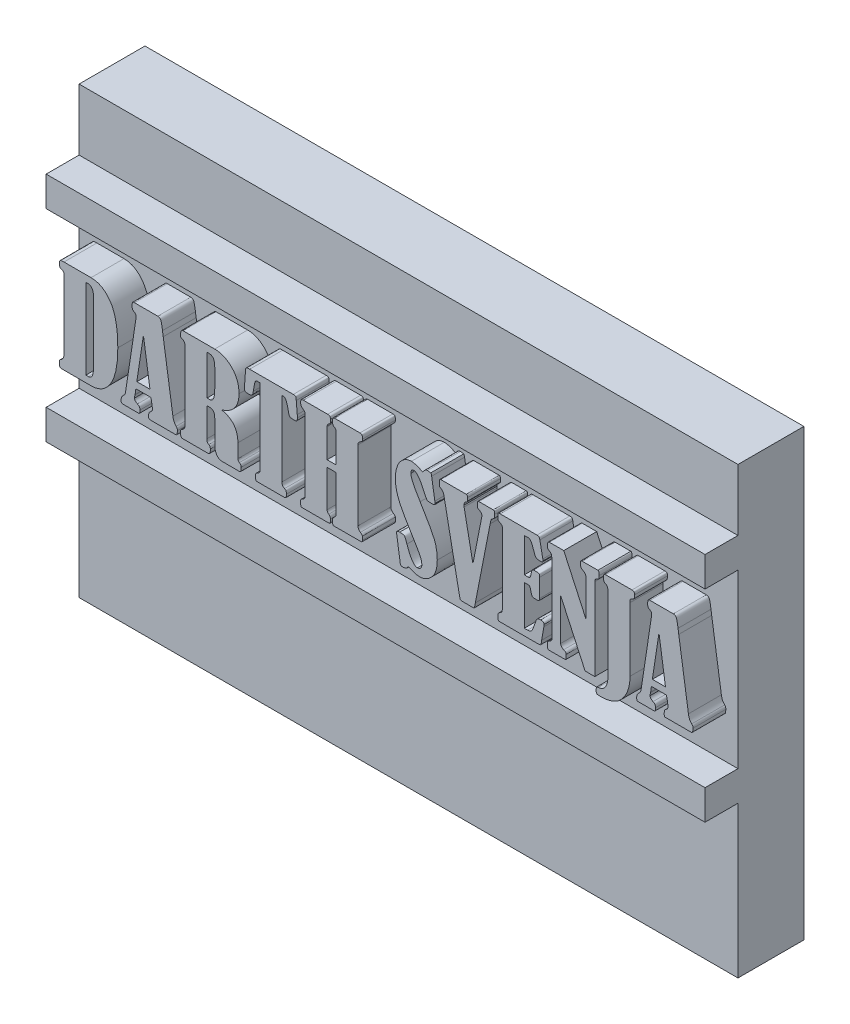
from build123d import *

# Parameters (mm, degrees)
ESQUISSE1_W                = 40
ESQUISSE1_H                = 27
BOSS_EXTRU_1_DEPTH         = 4
BOSS_EXTRU_2_DEPTH         = 2
ESQUISSE3_W                = 40
ESQUISSE3_H                = 1.816877175
BOSS_EXTRU_3_DEPTH         = 2
R_P_TITION_LIN_AIRE1_COUNT = 2
R_P_TITION_LIN_AIRE1_PITCH = 12.26


with BuildPart() as part:
    # Esquisse1 → Boss.-Extru.1 (new body)
    with BuildSketch(Plane.XY):
        Rectangle(ESQUISSE1_W, ESQUISSE1_H)
    extrude(amount=BOSS_EXTRU_1_DEPTH)

    # Esquisse2 → Boss.-Extru.2 (add)
    # profile 1 of 11: a face of its own
    with BuildSketch(Plane.XY.offset(4)):
        with BuildLine():
            Line((-18.925733379, 0.775336471), (-18.925733379, 5.108652302))
            add(Edge.make_bspline(
                [(-18.925733379, 5.108652302), (-18.928741812, 5.120210724), (-18.934971831, 5.14414651), (-18.961777866, 5.173838754), (-18.998534886, 5.199932874), (-19.029109465, 5.21048498), (-19.045900083, 5.216279871)],
                knots=[0, 0, 0, 0, 0.833518137, 1.726093046, 2.751240305, 4, 4, 4, 4], degree=3))
            add(Edge.make_bspline(
                [(-19.045900083, 5.216279871), (-19.059378664, 5.220249751), (-19.084722633, 5.227714373), (-19.116778882, 5.246559067), (-19.144543348, 5.264636651), (-19.165107868, 5.28992169), (-19.178780556, 5.323883193), (-19.187548846, 5.369125534), (-19.191986595, 5.42761522), (-19.192791378, 5.471235512), (-19.193234911, 5.49527561)],
                knots=[0, 0, 0, 0, 0.957240797, 1.799913688, 2.534152136, 3.211652755, 3.990931568, 5.014701102, 6.354736479, 8, 8, 8, 8], degree=3))
            add(Edge.make_bspline(
                [(-19.193234911, 5.49527561), (-19.192671875, 5.512733445), (-19.191639286, 5.544750491), (-19.183527803, 5.588217409), (-19.170746982, 5.62267364), (-19.149476553, 5.650051629), (-19.113636096, 5.666874602), (-19.063818944, 5.67660366), (-18.996986933, 5.684019411), (-18.946657149, 5.68426805), (-18.918418884, 5.684407552)],
                knots=[0, 0, 0, 0, 1.050348796, 1.926302044, 2.650576941, 3.24663545, 3.959590465, 4.971778437, 6.300971841, 8, 8, 8, 8], degree=3))
            Line((-18.918418884, 5.684407552), (-17.274747362, 5.684407552))
            add(Edge.make_bspline(
                [(-17.274747362, 5.684407552), (-17.217129405, 5.682480141), (-17.103797399, 5.678689008), (-16.93788779, 5.646217219), (-16.780066098, 5.593473739), (-16.628812092, 5.521006241), (-16.486587843, 5.425806115), (-16.351294082, 5.310698792), (-16.225408732, 5.173609613), (-16.126841571, 5.045144477), (-16.052746476, 4.931748895), (-15.999904167, 4.838076921), (-15.952898861, 4.736891853), (-15.907434495, 4.629730047), (-15.865565888, 4.515814005), (-15.828256879, 4.394257353), (-15.794118733, 4.265918355), (-15.762091347, 4.131311331), (-15.736934285, 3.989075896), (-15.712480045, 3.840832937), (-15.692592123, 3.685046337), (-15.677386751, 3.522598412), (-15.664888948, 3.353284793), (-15.655221795, 3.17737295), (-15.650289137, 2.994443336), (-15.649329008, 2.870070953), (-15.648839614, 2.806676229)],
                knots=[0, 0, 0, 0, 1.123620386, 2.210112249, 3.284867385, 4.364127053, 5.472657655, 6.615441309, 7.822635826, 9.097877066, 9.770951855, 10.464847598, 11.194573886, 11.946994597, 12.736219135, 13.561810185, 14.427451893, 15.327709291, 16.260953282, 17.245466532, 18.259730213, 19.325007206, 20.429194543, 21.572786532, 22.762807913, 24, 24, 24, 24], degree=3))
            add(Edge.make_bspline(
                [(-15.648839614, 2.806676229), (-15.650407151, 2.693107151), (-15.653448551, 2.472755743), (-15.672142793, 2.153115422), (-15.708272002, 1.856108278), (-15.755082021, 1.580743479), (-15.817990174, 1.328143698), (-15.891925364, 1.096217914), (-15.983381133, 0.887799028), (-16.086565081, 0.700673712), (-16.201758126, 0.535902945), (-16.326329763, 0.392742758), (-16.45969506, 0.271334611), (-16.602140253, 0.171322573), (-16.754720408, 0.094588827), (-16.916251309, 0.040415745), (-17.086176216, 0.005084803), (-17.202816568, 0.001715568), (-17.262208228, 0)],
                knots=[0, 0, 0, 0, 1.51091999, 2.93154929, 4.256904459, 5.489491745, 6.644787685, 7.717396437, 8.723764184, 9.66754103, 10.555814179, 11.393173607, 12.187058278, 12.949305222, 13.701528974, 14.450305387, 15.210916849, 16, 16, 16, 16], degree=3))
            Line((-17.262208228, 0), (-19.060529073, 0))
            add(Edge.make_bspline(
                [(-19.060529073, 0), (-19.082015427, 0.001259276), (-19.119644307, 0.003464637), (-19.163580186, 0.027602207), (-19.179665504, 0.061955699), (-19.187179903, 0.097474243), (-19.192101791, 0.143380425), (-19.192833024, 0.177625345), (-19.193234911, 0.196446437)],
                knots=[0, 0, 0, 0, 1.389771436, 2.43389569, 3.018611527, 3.783947239, 4.782051988, 6, 6, 6, 6], degree=3))
            add(Edge.make_bspline(
                [(-19.193234911, 0.196446437), (-19.192762544, 0.21872364), (-19.191913734, 0.258754235), (-19.192380556, 0.311891488), (-19.187822964, 0.350971707), (-19.18698661, 0.380406878), (-19.175332934, 0.403486872), (-19.156321365, 0.424241269), (-19.130310109, 0.447644542), (-19.108193238, 0.460870142), (-19.09605662, 0.468127681)],
                knots=[0, 0, 0, 0, 1.716087145, 3.083690012, 4.078937213, 4.754010596, 5.317670953, 6.021416998, 6.914253895, 8, 8, 8, 8], degree=3))
            add(Edge.make_bspline(
                [(-19.09605662, 0.468127681), (-19.07018487, 0.486376514), (-19.020222281, 0.521618), (-18.964763545, 0.595138346), (-18.930842003, 0.681301109), (-18.927472678, 0.743320886), (-18.925733379, 0.775336471)],
                knots=[0, 0, 0, 0, 1.027655783, 1.984571723, 2.959604197, 4, 4, 4, 4], degree=3))
        make_face()
        with BuildLine():
            Line((-17.58822572, 5.283155254), (-17.58822572, 0.401252298))
            Line((-17.58822572, 0.401252298), (-17.434621325, 0.401252298))
            add(Edge.make_bspline(
                [(-17.434621325, 0.401252298), (-17.408838732, 0.403104972), (-17.359105259, 0.406678697), (-17.290342219, 0.439397836), (-17.234234141, 0.493284817), (-17.199902888, 0.553961327), (-17.177125101, 0.612261922), (-17.161522667, 0.665374508), (-17.149737978, 0.726738388), (-17.137695126, 0.795567765), (-17.129674567, 0.87271782), (-17.125186239, 0.957821575), (-17.1202393, 1.050447856), (-17.120146285, 1.114930053), (-17.120098039, 1.148375717)],
                knots=[0, 0, 0, 0, 1.028048118, 1.983058998, 2.979958536, 4.099818922, 4.744963976, 5.486683311, 6.313070002, 7.246640392, 8.285144943, 9.417452445, 10.660482736, 12, 12, 12, 12], degree=3))
            Line((-17.120098039, 1.148375717), (-17.120098039, 4.751286974))
            add(Edge.make_bspline(
                [(-17.120098039, 4.751286974), (-17.121395407, 4.788957387), (-17.12387193, 4.860865799), (-17.139891028, 4.963438986), (-17.169520441, 5.054623004), (-17.209567883, 5.134286709), (-17.260636524, 5.200750102), (-17.323587228, 5.249655051), (-17.397937167, 5.278000546), (-17.450405134, 5.281401401), (-17.477463367, 5.283155254)],
                knots=[0, 0, 0, 0, 1.261608383, 2.408262842, 3.463155542, 4.459486921, 5.381204471, 6.246669928, 7.095790905, 8, 8, 8, 8], degree=3))
            Line((-17.477463367, 5.283155254), (-17.58822572, 5.283155254))
        make_face(mode=Mode.SUBTRACT)
    # profile 2 of 11: a face of its own
    with BuildSketch(Plane.XY.offset(4)):
        with BuildLine():
            Line((-13.636308558, 1.203756893), (-14.554800146, 1.203756893))
            Line((-14.554800146, 1.203756893), (-14.59659726, 0.884008969))
            add(Edge.make_bspline(
                [(-14.59659726, 0.884008969), (-14.597168205, 0.879798043), (-14.598629611, 0.869019649), (-14.602561135, 0.858854773), (-14.604956683, 0.852661133)],
                knots=[0, 0, 0, 0, 0.781364233, 2, 2, 2, 2], degree=3))
            add(Edge.make_bspline(
                [(-14.604956683, 0.852661133), (-14.613920456, 0.821176517), (-14.630763851, 0.762015286), (-14.633826726, 0.70061343), (-14.635259591, 0.671888613)],
                knots=[0, 0, 0, 0, 1.064366487, 2, 2, 2, 2], degree=3))
            add(Edge.make_bspline(
                [(-14.635259591, 0.671888613), (-14.63288939, 0.650890967), (-14.628006219, 0.607630885), (-14.590535893, 0.547710951), (-14.531630602, 0.49470641), (-14.481715206, 0.468043129), (-14.454487071, 0.453498691)],
                knots=[0, 0, 0, 0, 0.840672066, 1.731981803, 2.762828515, 4, 4, 4, 4], degree=3))
            add(Edge.make_bspline(
                [(-14.454487071, 0.453498691), (-14.439673402, 0.446158136), (-14.41246809, 0.432677204), (-14.377246703, 0.409404251), (-14.350323328, 0.386237596), (-14.333043162, 0.359525441), (-14.322555306, 0.329437742), (-14.31549546, 0.29323087), (-14.311599034, 0.249474855), (-14.311425312, 0.217701088), (-14.311331955, 0.200626149)],
                knots=[0, 0, 0, 0, 1.25096552, 2.297398811, 3.193691988, 3.918182762, 4.677851844, 5.593736345, 6.706895307, 8, 8, 8, 8], degree=3))
            add(Edge.make_bspline(
                [(-14.311331955, 0.200626149), (-14.311500685, 0.179389113), (-14.311802429, 0.141410608), (-14.314464828, 0.091345343), (-14.319359417, 0.055494972), (-14.327028868, 0.02423588), (-14.359626725, 0.000807289), (-14.388928852, 0.000301766), (-14.40642039, 0)],
                knots=[0, 0, 0, 0, 1.472901535, 2.634011485, 3.463691214, 3.998112282, 4.804998164, 6, 6, 6, 6], degree=3))
            Line((-14.40642039, 0), (-15.36775402, 0))
            add(Edge.make_bspline(
                [(-15.36775402, 0), (-15.380349686, 0.002091702), (-15.406052126, 0.006359982), (-15.433611903, 0.042977466), (-15.445732026, 0.095574202), (-15.447309216, 0.136442806), (-15.448213465, 0.159873962)],
                knots=[0, 0, 0, 0, 0.74805772, 1.526470116, 2.5818536, 4, 4, 4, 4], degree=3))
            add(Edge.make_bspline(
                [(-15.448213465, 0.159873962), (-15.446685564, 0.190367239), (-15.443735507, 0.249243346), (-15.418759264, 0.332489534), (-15.378698368, 0.407553575), (-15.339577081, 0.447711101), (-15.319687338, 0.468127681)],
                knots=[0, 0, 0, 0, 1.062449005, 2.051365735, 3.009290399, 4, 4, 4, 4], degree=3))
            add(Edge.make_bspline(
                [(-15.319687338, 0.468127681), (-15.301399232, 0.486114233), (-15.266201812, 0.520731281), (-15.223744916, 0.578383252), (-15.194284801, 0.638718974), (-15.185157973, 0.680697291), (-15.180711933, 0.701146593)],
                knots=[0, 0, 0, 0, 1.112161245, 2.140473456, 3.094150907, 4, 4, 4, 4], degree=3))
            Line((-15.180711933, 0.701146593), (-14.551665362, 4.864139183))
            add(Edge.make_bspline(
                [(-14.551665362, 4.864139183), (-14.546356717, 4.893315273), (-14.536544402, 4.947243336), (-14.534732992, 5.002010722), (-14.533901589, 5.027147929)],
                knots=[0, 0, 0, 0, 1.082037365, 2, 2, 2, 2], degree=3))
            add(Edge.make_bspline(
                [(-14.533901589, 5.027147929), (-14.536031525, 5.045036913), (-14.540490574, 5.082487723), (-14.576762921, 5.133388952), (-14.630100069, 5.180854703), (-14.675998224, 5.205109823), (-14.701090046, 5.218369727)],
                knots=[0, 0, 0, 0, 0.79940704, 1.673568499, 2.728175345, 4, 4, 4, 4], degree=3))
            add(Edge.make_bspline(
                [(-14.701090046, 5.218369727), (-14.713405171, 5.226621688), (-14.738740866, 5.243598305), (-14.762777986, 5.287419755), (-14.776839415, 5.341438321), (-14.778540341, 5.381610309), (-14.779459635, 5.403321958)],
                knots=[0, 0, 0, 0, 0.833907349, 1.715583288, 2.765347298, 4, 4, 4, 4], degree=3))
            add(Edge.make_bspline(
                [(-14.779459635, 5.403321958), (-14.779372465, 5.432225099), (-14.779216905, 5.483804403), (-14.775698493, 5.552357172), (-14.768575655, 5.602198285), (-14.760602305, 5.638041), (-14.74214763, 5.66206531), (-14.714314738, 5.674383627), (-14.679350621, 5.683106154), (-14.653109065, 5.683939988), (-14.638394374, 5.684407552)],
                knots=[0, 0, 0, 0, 1.868269368, 3.334033259, 4.425827617, 5.130787472, 5.675639649, 6.309859941, 7.052270825, 8, 8, 8, 8], degree=3))
            Line((-14.638394374, 5.684407552), (-13.221472198, 5.684407552))
            add(Edge.make_bspline(
                [(-13.221472198, 5.684407552), (-13.201422628, 5.683084205), (-13.163218609, 5.680562597), (-13.109876039, 5.658875191), (-13.067797293, 5.620424048), (-13.042958235, 5.57664554), (-13.02574718, 5.534195659), (-13.013696851, 5.49228598), (-12.999615223, 5.442752087), (-12.988109683, 5.383809537), (-12.973640386, 5.317235983), (-12.962055671, 5.241341436), (-12.947808433, 5.157608746), (-12.940175014, 5.098583523), (-12.936206892, 5.067900115)],
                knots=[0, 0, 0, 0, 0.971429483, 1.851037742, 2.737450956, 3.686079699, 4.270339729, 4.960568525, 5.801766102, 6.770540998, 7.875243843, 9.109962649, 10.497655935, 12, 12, 12, 12], degree=3))
            add(Edge.make_bspline(
                [(-12.936206892, 5.067900115), (-12.928818679, 5.017754108), (-12.914099692, 4.917851953), (-12.90025846, 4.817824415), (-12.89336485, 4.76800582)],
                knots=[0, 0, 0, 0, 1.003902406, 2, 2, 2, 2], degree=3))
            Line((-12.89336485, 4.76800582), (-12.305070466, 0.885053896))
            add(Edge.make_bspline(
                [(-12.305070466, 0.885053896), (-12.297286708, 0.840510487), (-12.282361999, 0.75510219), (-12.240616277, 0.636874491), (-12.183287011, 0.534900331), (-12.132375984, 0.480160463), (-12.1075791, 0.453498691)],
                knots=[0, 0, 0, 0, 1.120989026, 2.14940361, 3.098642726, 4, 4, 4, 4], degree=3))
            add(Edge.make_bspline(
                [(-12.1075791, 0.453498691), (-12.095512546, 0.442670705), (-12.074968622, 0.424235507), (-12.052375568, 0.398478577), (-12.042981388, 0.372574414), (-12.040171423, 0.343499362), (-12.038230473, 0.30341605), (-12.037807204, 0.273082801), (-12.037568934, 0.256007325)],
                knots=[0, 0, 0, 0, 1.321877426, 2.250563804, 2.734350995, 3.53512125, 4.612447447, 6, 6, 6, 6], degree=3))
            add(Edge.make_bspline(
                [(-12.037568934, 0.256007325), (-12.037455313, 0.229520477), (-12.037251688, 0.182052293), (-12.042888097, 0.119254307), (-12.048836619, 0.073171673), (-12.058840806, 0.040704249), (-12.076583436, 0.020291814), (-12.101095489, 0.008984917), (-12.131010386, 0.000280243), (-12.153819625, 9.8052e-05), (-12.16609506, 0)],
                knots=[0, 0, 0, 0, 1.893780816, 3.393923383, 4.504014901, 5.221405687, 5.786290747, 6.376963159, 7.126516973, 8, 8, 8, 8], degree=3))
            Line((-12.16609506, 0), (-13.707363652, 0))
            add(Edge.make_bspline(
                [(-13.707363652, 0), (-13.71817798, 0.001521958), (-13.740222835, 0.004624448), (-13.762191363, 0.036138049), (-13.775265663, 0.078534769), (-13.775941626, 0.112310498), (-13.776328891, 0.13166091)],
                knots=[0, 0, 0, 0, 0.763634772, 1.556658743, 2.600188309, 4, 4, 4, 4], degree=3))
            add(Edge.make_bspline(
                [(-13.776328891, 0.13166091), (-13.776172862, 0.156738268), (-13.77589315, 0.201694095), (-13.773060562, 0.261391915), (-13.768367602, 0.305395517), (-13.761510924, 0.337907377), (-13.746752097, 0.362454311), (-13.726038463, 0.385415039), (-13.698546397, 0.410818955), (-13.676558608, 0.426920361), (-13.66452161, 0.435734917)],
                knots=[0, 0, 0, 0, 1.74184257, 3.1225767, 4.145727599, 4.820448741, 5.405524969, 6.108699083, 6.964626, 8, 8, 8, 8], degree=3))
            add(Edge.make_bspline(
                [(-13.66452161, 0.435734917), (-13.646688722, 0.449217638), (-13.613113578, 0.474602438), (-13.576020766, 0.52400304), (-13.552494349, 0.578638197), (-13.549864594, 0.617667328), (-13.548534618, 0.637405994)],
                knots=[0, 0, 0, 0, 1.10212611, 2.075044977, 3.026469619, 4, 4, 4, 4], degree=3))
            add(Edge.make_bspline(
                [(-13.548534618, 0.637405994), (-13.548728843, 0.649256808), (-13.549169659, 0.676153618), (-13.553982028, 0.721802893), (-13.561473485, 0.777462569), (-13.570555376, 0.843408233), (-13.583726718, 0.918838917), (-13.59796814, 1.004651053), (-13.615906478, 1.100763466), (-13.629273577, 1.168243027), (-13.636308558, 1.203756893)],
                knots=[0, 0, 0, 0, 0.495686497, 1.125018515, 1.918529162, 2.845930934, 3.909639159, 5.121892687, 6.485278823, 8, 8, 8, 8], degree=3))
        make_face()
        Polygon((-14.09398696, 4.251811458), (-14.49419433, 1.605009191), (-13.697959302, 1.605009191), align=None, mode=Mode.SUBTRACT)
    # profile 3 of 11: a face of its own
    with BuildSketch(Plane.XY.offset(4)):
        with BuildLine():
            Line((-10.231933594, 2.47438917), (-10.231933594, 0.737719068))
            add(Edge.make_bspline(
                [(-10.231933594, 0.737719068), (-10.231830513, 0.718900353), (-10.23164326, 0.684714904), (-10.228115859, 0.638734689), (-10.224920247, 0.602539781), (-10.215340925, 0.564901384), (-10.182757014, 0.522850117), (-10.147244492, 0.499562876), (-10.12639588, 0.485891454)],
                knots=[0, 0, 0, 0, 1.157642214, 2.102934128, 2.836721015, 3.393183753, 4.469596127, 6, 6, 6, 6], degree=3))
            add(Edge.make_bspline(
                [(-10.12639588, 0.485891454), (-10.111640709, 0.475220261), (-10.082522425, 0.454161418), (-10.052770421, 0.407372957), (-10.03439024, 0.352103749), (-10.032378955, 0.311905503), (-10.031307445, 0.290489945)],
                knots=[0, 0, 0, 0, 0.954164084, 1.882975139, 2.872158005, 4, 4, 4, 4], degree=3))
            add(Edge.make_bspline(
                [(-10.031307445, 0.290489945), (-10.031433574, 0.260505106), (-10.031658474, 0.207039185), (-10.039216145, 0.136112862), (-10.048486103, 0.083350981), (-10.065671751, 0.046369708), (-10.091235922, 0.024098489), (-10.122590688, 0.009436408), (-10.161922725, 0.001795354), (-10.190456187, 0.000628109), (-10.205810397, 0)],
                knots=[0, 0, 0, 0, 1.80177751, 3.212746754, 4.285052942, 5.015738614, 5.608899473, 6.283388176, 7.076269881, 8, 8, 8, 8], degree=3))
            Line((-10.205810397, 0), (-11.709461586, 0))
            add(Edge.make_bspline(
                [(-11.709461586, 0), (-11.728651712, 0.001857606), (-11.765454159, 0.005420085), (-11.810206488, 0.044864278), (-11.833545144, 0.105451357), (-11.835718951, 0.151636116), (-11.836942785, 0.177637736)],
                knots=[0, 0, 0, 0, 0.917390226, 1.759352973, 2.738535071, 4, 4, 4, 4], degree=3))
            add(Edge.make_bspline(
                [(-11.836942785, 0.177637736), (-11.836676388, 0.203761506), (-11.836196775, 0.25079404), (-11.834494444, 0.313526797), (-11.831035894, 0.360927325), (-11.827900896, 0.403103395), (-11.806900295, 0.44598981), (-11.775381858, 0.460427902), (-11.758573196, 0.468127681)],
                knots=[0, 0, 0, 0, 1.460230368, 2.62895959, 3.506964585, 4.11547609, 4.994990612, 6, 6, 6, 6], degree=3))
            add(Edge.make_bspline(
                [(-11.758573196, 0.468127681), (-11.729752749, 0.482332883), (-11.673676934, 0.509971881), (-11.611816407, 0.58234003), (-11.574395595, 0.672743793), (-11.571160096, 0.739060916), (-11.569441253, 0.774291543)],
                knots=[0, 0, 0, 0, 0.995711383, 1.937351208, 2.904228543, 4, 4, 4, 4], degree=3))
            Line((-11.569441253, 0.774291543), (-11.569441253, 4.935194277))
            add(Edge.make_bspline(
                [(-11.569441253, 4.935194277), (-11.57085812, 4.970260183), (-11.573439774, 5.034153287), (-11.600932569, 5.120089128), (-11.651620964, 5.184930524), (-11.698489823, 5.205807381), (-11.72200072, 5.216279871)],
                knots=[0, 0, 0, 0, 1.223095291, 2.228585119, 3.11140244, 4, 4, 4, 4], degree=3))
            add(Edge.make_bspline(
                [(-11.72200072, 5.216279871), (-11.742539012, 5.224198443), (-11.776346979, 5.23723316), (-11.816878813, 5.260484262), (-11.828690881, 5.292270014), (-11.832036908, 5.325541436), (-11.837152887, 5.371158622), (-11.837018605, 5.405739691), (-11.836942785, 5.425265443)],
                knots=[0, 0, 0, 0, 1.492056203, 2.45606527, 2.936097254, 3.690257184, 4.695833713, 6, 6, 6, 6], degree=3))
            add(Edge.make_bspline(
                [(-11.836942785, 5.425265443), (-11.836678572, 5.445489683), (-11.836179996, 5.483653372), (-11.829033228, 5.536614477), (-11.817495191, 5.581504268), (-11.802593, 5.619081787), (-11.780908738, 5.647993868), (-11.755785243, 5.670180417), (-11.724307981, 5.682078714), (-11.702238161, 5.683605883), (-11.690652885, 5.684407552)],
                knots=[0, 0, 0, 0, 1.454614593, 2.744897179, 3.833119366, 4.787553361, 5.629741014, 6.41278617, 7.16681194, 8, 8, 8, 8], degree=3))
            Line((-11.690652885, 5.684407552), (-9.766940697, 5.684407552))
            add(Edge.make_bspline(
                [(-9.766940697, 5.684407552), (-9.719860295, 5.682823127), (-9.626333683, 5.679675621), (-9.487806164, 5.659896276), (-9.35320964, 5.624742517), (-9.222393416, 5.576980903), (-9.0960358, 5.514281966), (-8.973414355, 5.438990482), (-8.855061341, 5.349132365), (-8.740835461, 5.248094185), (-8.635621091, 5.134801305), (-8.542671759, 5.010926579), (-8.465493412, 4.87662188), (-8.402406261, 4.733249197), (-8.353326103, 4.580895069), (-8.317757084, 4.419314205), (-8.296793448, 4.248183149), (-8.293984851, 4.131006679), (-8.292547488, 4.071038938)],
                knots=[0, 0, 0, 0, 0.927271574, 1.842052437, 2.748773855, 3.662422435, 4.579668881, 5.522015346, 6.491944425, 7.502499591, 8.521816758, 9.531533482, 10.545713886, 11.565354126, 12.610921754, 13.692718051, 14.819195644, 16, 16, 16, 16], degree=3))
            add(Edge.make_bspline(
                [(-8.292547488, 4.071038938), (-8.293280602, 4.028160403), (-8.294714356, 3.944302667), (-8.307974464, 3.821480526), (-8.327221922, 3.704352815), (-8.355432901, 3.59231171), (-8.393313118, 3.48684942), (-8.436959561, 3.385849327), (-8.490819696, 3.291714176), (-8.552386883, 3.202930098), (-8.621916114, 3.119617954), (-8.69973803, 3.042243261), (-8.785050546, 2.969599828), (-8.880448735, 2.905590795), (-8.981714057, 2.843734343), (-9.092908203, 2.790569968), (-9.211070694, 2.740447381), (-9.294049726, 2.713736101), (-9.336430419, 2.700093587)],
                knots=[0, 0, 0, 0, 1.101318519, 2.153853387, 3.170470246, 4.149361966, 5.117352776, 6.046894524, 6.972637627, 7.89859698, 8.819830582, 9.756367757, 10.715423396, 11.693455702, 12.704859918, 13.761457689, 14.856687399, 16, 16, 16, 16], degree=3))
            add(Edge.make_bspline(
                [(-9.336430419, 2.700093587), (-9.296903025, 2.690586122), (-9.219553539, 2.671981365), (-9.10886651, 2.634667803), (-9.004728314, 2.593828099), (-8.909275217, 2.544066993), (-8.821086318, 2.488654816), (-8.740240149, 2.427144671), (-8.66776917, 2.358541076), (-8.602204768, 2.283993708), (-8.545286835, 2.2022368), (-8.494325844, 2.115286341), (-8.452876848, 2.02145515), (-8.417789829, 1.92171175), (-8.392443416, 1.815124557), (-8.373470348, 1.702387302), (-8.361966883, 1.583650267), (-8.360281786, 1.502283053), (-8.359422871, 1.460809147)],
                knots=[0, 0, 0, 0, 1.124822087, 2.201116835, 3.230616586, 4.218128893, 5.175771186, 6.111068279, 7.025050989, 7.933882736, 8.854099464, 9.778549414, 10.719346699, 11.68899948, 12.701564317, 13.747724881, 14.851986639, 16, 16, 16, 16], degree=3))
            Line((-8.359422871, 1.460809147), (-8.359422871, 0.620687148))
            add(Edge.make_bspline(
                [(-8.359422871, 0.620687148), (-8.358150173, 0.604171658), (-8.3556953, 0.572315364), (-8.338442498, 0.52724716), (-8.307910315, 0.489673271), (-8.281235636, 0.471326577), (-8.267469219, 0.461858114)],
                knots=[0, 0, 0, 0, 1.029939665, 1.986623469, 2.960925436, 4, 4, 4, 4], degree=3))
            add(Edge.make_bspline(
                [(-8.267469219, 0.461858114), (-8.250613544, 0.45131542), (-8.218272708, 0.431087244), (-8.183863865, 0.385374431), (-8.161302699, 0.332540346), (-8.159653936, 0.293874161), (-8.158796722, 0.273771099)],
                knots=[0, 0, 0, 0, 1.034675545, 1.985222998, 2.952490779, 4, 4, 4, 4], degree=3))
            add(Edge.make_bspline(
                [(-8.158796722, 0.273771099), (-8.159447607, 0.244203117), (-8.160604671, 0.191640705), (-8.162698927, 0.121958339), (-8.172383652, 0.073110899), (-8.18234044, 0.037789276), (-8.205886281, 0.018228643), (-8.23703964, 0.007637133), (-8.277952937, 0.000537091), (-8.308879464, 0.000191274), (-8.325985179, 0)],
                knots=[0, 0, 0, 0, 1.828894481, 3.251189253, 4.28054923, 4.927652845, 5.445693131, 6.092796746, 6.945110238, 8, 8, 8, 8], degree=3))
            Line((-8.325985179, 0), (-9.345834769, 0))
            add(Edge.make_bspline(
                [(-9.345834769, 0), (-9.375187389, 0.001961209), (-9.43387378, 0.005882366), (-9.515335784, 0.046097292), (-9.588995071, 0.106642178), (-9.64958378, 0.191158893), (-9.700185843, 0.291029307), (-9.737971301, 0.403565507), (-9.759972712, 0.527528578), (-9.762496439, 0.613629698), (-9.763805913, 0.658304551)],
                knots=[0, 0, 0, 0, 0.813636081, 1.626749688, 2.482805442, 3.454592677, 4.502006219, 5.599093323, 6.754253666, 8, 8, 8, 8], degree=3))
            Line((-9.763805913, 0.658304551), (-9.763805913, 2.062687593))
            add(Edge.make_bspline(
                [(-9.763805913, 2.062687593), (-9.764714555, 2.094787616), (-9.766425904, 2.155245275), (-9.781437323, 2.240227339), (-9.808921103, 2.312224763), (-9.845246743, 2.373094433), (-9.894972699, 2.419582494), (-9.955867296, 2.450961832), (-10.026141961, 2.47172104), (-10.076772332, 2.473469406), (-10.103407467, 2.47438917)],
                knots=[0, 0, 0, 0, 1.262601899, 2.378003113, 3.375648288, 4.280612104, 5.14351071, 6.014100862, 6.955277437, 8, 8, 8, 8], degree=3))
            Line((-10.103407467, 2.47438917), (-10.231933594, 2.47438917))
        make_face()
        with BuildLine():
            Line((-10.231933594, 5.283155254), (-10.231933594, 2.875641468))
            Line((-10.231933594, 2.875641468), (-10.045936435, 2.875641468))
            add(Edge.make_bspline(
                [(-10.045936435, 2.875641468), (-10.023512553, 2.877824048), (-9.978777465, 2.88217824), (-9.918124994, 2.919566948), (-9.868271274, 2.977669804), (-9.828940712, 3.057899653), (-9.800065754, 3.159484472), (-9.778936204, 3.282438087), (-9.765474986, 3.427069861), (-9.76438717, 3.53077781), (-9.763805913, 3.586192412)],
                knots=[0, 0, 0, 0, 0.640792811, 1.278365734, 1.988141726, 2.821648289, 3.826472756, 5.017514704, 6.406359027, 8, 8, 8, 8], degree=3))
            Line((-9.763805913, 3.586192412), (-9.763805913, 4.736657984))
            add(Edge.make_bspline(
                [(-9.763805913, 4.736657984), (-9.764564359, 4.783037737), (-9.765967525, 4.868842797), (-9.781852854, 4.986616587), (-9.809166672, 5.083153698), (-9.849049624, 5.159566684), (-9.902658561, 5.216901683), (-9.969137088, 5.256752702), (-10.048290037, 5.279733926), (-10.104992889, 5.281977591), (-10.134755303, 5.283155254)],
                knots=[0, 0, 0, 0, 1.468369082, 2.716562522, 3.753213758, 4.631949918, 5.42021953, 6.207330205, 7.059056472, 8, 8, 8, 8], degree=3))
            Line((-10.134755303, 5.283155254), (-10.231933594, 5.283155254))
        make_face(mode=Mode.SUBTRACT)
    # profile 4 of 11: a face of its own
    with BuildSketch(Plane.XY.offset(4)):
        with BuildLine():
            Line((-7.021915211, 5.283155254), (-7.185968885, 5.283155254))
            add(Edge.make_bspline(
                [(-7.185968885, 5.283155254), (-7.198734992, 5.281927524), (-7.224649637, 5.279435285), (-7.260558374, 5.259001512), (-7.29017633, 5.225602761), (-7.310982584, 5.188797815), (-7.325320813, 5.149409877), (-7.337711766, 5.108222766), (-7.35156259, 5.056482959), (-7.36286251, 4.993277825), (-7.378432862, 4.920453371), (-7.392405272, 4.836311039), (-7.408441556, 4.741684078), (-7.418095263, 4.674683237), (-7.423167509, 4.639479693)],
                knots=[0, 0, 0, 0, 0.630061034, 1.27899662, 1.987434139, 2.822534051, 3.35798297, 4.062412621, 4.954289276, 6.010616395, 7.242998034, 8.645071702, 10.237255494, 12, 12, 12, 12], degree=3))
            add(Edge.make_bspline(
                [(-7.423167509, 4.639479693), (-7.428329663, 4.610145929), (-7.437679954, 4.557013223), (-7.455763082, 4.486283994), (-7.476651585, 4.433383346), (-7.502160919, 4.394501611), (-7.538775591, 4.370933979), (-7.586360088, 4.357248171), (-7.646442298, 4.348241517), (-7.691324517, 4.347372675), (-7.71574731, 4.346899893)],
                knots=[0, 0, 0, 0, 1.487301085, 2.693971693, 3.637224955, 4.322660357, 4.973920965, 5.760473001, 6.781354695, 8, 8, 8, 8], degree=3))
            add(Edge.make_bspline(
                [(-7.71574731, 4.346899893), (-7.739117788, 4.347039436), (-7.781473315, 4.347292339), (-7.838094687, 4.355029392), (-7.88189512, 4.364012365), (-7.914992762, 4.379726724), (-7.935106987, 4.406106821), (-7.948641847, 4.438756379), (-7.956477285, 4.479954822), (-7.957575465, 4.510224318), (-7.958170573, 4.526627484)],
                knots=[0, 0, 0, 0, 1.561207501, 2.829457202, 3.812391251, 4.552231583, 5.214292727, 5.975812654, 6.903084456, 8, 8, 8, 8], degree=3))
            add(Edge.make_bspline(
                [(-7.958170573, 4.526627484), (-7.957912952, 4.547528334), (-7.957401893, 4.588990636), (-7.955820175, 4.630425871), (-7.955035789, 4.6509739)],
                knots=[0, 0, 0, 0, 1.008185702, 2, 2, 2, 2], degree=3))
            Line((-7.955035789, 4.6509739), (-7.900699541, 5.456613279))
            add(Edge.make_bspline(
                [(-7.900699541, 5.456613279), (-7.899732506, 5.478242383), (-7.897977324, 5.517499522), (-7.889901295, 5.570175849), (-7.878449844, 5.611042069), (-7.859475876, 5.642824636), (-7.825821149, 5.662993301), (-7.779475205, 5.676618655), (-7.716559688, 5.682341039), (-7.669766244, 5.683667278), (-7.643647287, 5.684407552)],
                knots=[0, 0, 0, 0, 1.252673427, 2.273620487, 3.077090109, 3.703426823, 4.357698918, 5.288673477, 6.486603819, 8, 8, 8, 8], degree=3))
            Line((-7.643647287, 5.684407552), (-4.996845021, 5.684407552))
            add(Edge.make_bspline(
                [(-4.996845021, 5.684407552), (-4.979403604, 5.684045457), (-4.948257492, 5.683398843), (-4.907290661, 5.678298283), (-4.876756022, 5.671429065), (-4.854085357, 5.656580943), (-4.841313499, 5.628320665), (-4.832329284, 5.586977695), (-4.822746348, 5.527930595), (-4.819154633, 5.482424258), (-4.817117429, 5.456613279)],
                knots=[0, 0, 0, 0, 1.192639281, 2.129762485, 2.82381107, 3.319758786, 3.917030254, 4.876615262, 6.228430935, 8, 8, 8, 8], degree=3))
            Line((-4.817117429, 5.456613279), (-4.755466686, 4.745017407))
            add(Edge.make_bspline(
                [(-4.755466686, 4.745017407), (-4.753462995, 4.717164049), (-4.749408913, 4.660808123), (-4.748574303, 4.604312377), (-4.748152191, 4.575739094)],
                knots=[0, 0, 0, 0, 0.988480187, 2, 2, 2, 2], degree=3))
            add(Edge.make_bspline(
                [(-4.748152191, 4.575739094), (-4.749634246, 4.545513898), (-4.752271082, 4.491737964), (-4.766287181, 4.426524243), (-4.797855789, 4.38870678), (-4.837608575, 4.372202667), (-4.89043672, 4.362559087), (-4.930595844, 4.361897359), (-4.952958051, 4.361528883)],
                knots=[0, 0, 0, 0, 1.541440631, 2.742493671, 3.280781023, 3.967959037, 4.868478269, 6, 6, 6, 6], degree=3))
            add(Edge.make_bspline(
                [(-4.952958051, 4.361528883), (-4.981515244, 4.361873572), (-5.033492164, 4.36250094), (-5.103277143, 4.36803474), (-5.156092188, 4.37800577), (-5.197638892, 4.39173496), (-5.226064635, 4.424102939), (-5.247442968, 4.470454831), (-5.26842892, 4.533918299), (-5.277881237, 4.582894782), (-5.283155254, 4.610221713)],
                knots=[0, 0, 0, 0, 1.417006454, 2.579092079, 3.459969567, 4.095179357, 4.693867064, 5.528289948, 6.620884002, 8, 8, 8, 8], degree=3))
            add(Edge.make_bspline(
                [(-5.283155254, 4.610221713), (-5.292644493, 4.657300298), (-5.310764451, 4.747198137), (-5.340882551, 4.875228458), (-5.37299481, 4.989629188), (-5.405776841, 5.089254015), (-5.43888126, 5.172768405), (-5.479064915, 5.233389884), (-5.524446479, 5.275695601), (-5.560126552, 5.280781463), (-5.576779983, 5.283155254)],
                knots=[0, 0, 0, 0, 1.500343381, 2.864946496, 4.108599565, 5.209786397, 6.145706639, 6.897277997, 7.485312023, 8, 8, 8, 8], degree=3))
            Line((-5.576779983, 5.283155254), (-5.684407552, 5.283155254))
            Line((-5.684407552, 5.283155254), (-5.684407552, 0.737719068))
            add(Edge.make_bspline(
                [(-5.684407552, 0.737719068), (-5.682485875, 0.707504979), (-5.678849529, 0.650331559), (-5.649157169, 0.571208391), (-5.596304293, 0.508277718), (-5.549585877, 0.481756324), (-5.525578518, 0.468127681)],
                knots=[0, 0, 0, 0, 1.0920629, 2.066485328, 3.006417903, 4, 4, 4, 4], degree=3))
            add(Edge.make_bspline(
                [(-5.525578518, 0.468127681), (-5.506678058, 0.458589631), (-5.472707594, 0.441446557), (-5.439947811, 0.404929991), (-5.427837253, 0.367671256), (-5.420959728, 0.330156165), (-5.417085052, 0.281158544), (-5.416970052, 0.24486675), (-5.41690602, 0.22465949)],
                knots=[0, 0, 0, 0, 1.314944114, 2.363395424, 2.940524103, 3.737107863, 4.740022354, 6, 6, 6, 6], degree=3))
            add(Edge.make_bspline(
                [(-5.41690602, 0.22465949), (-5.417090627, 0.199545621), (-5.417417034, 0.155141173), (-5.424157276, 0.097220056), (-5.430908084, 0.055308252), (-5.446898659, 0.027053051), (-5.472128068, 0.013660117), (-5.50385219, 0.00591796), (-5.545306462, 0.001175605), (-5.576421418, 0.000416587), (-5.593498828, 0)],
                knots=[0, 0, 0, 0, 1.71385034, 3.030300968, 3.982667593, 4.603146993, 5.15812064, 5.873929716, 6.833108566, 8, 8, 8, 8], degree=3))
            Line((-5.593498828, 0), (-7.145216699, 0))
            add(Edge.make_bspline(
                [(-7.145216699, 0), (-7.15914625, 0.000370764), (-7.18439949, 0.001042931), (-7.218872939, 0.006340724), (-7.244523799, 0.018282743), (-7.266245056, 0.034126707), (-7.277174387, 0.064445977), (-7.284806549, 0.106089173), (-7.287850509, 0.164061789), (-7.288854859, 0.207610587), (-7.289416743, 0.231973985)],
                knots=[0, 0, 0, 0, 1.022341971, 1.853429837, 2.527353022, 3.089519413, 3.763442599, 4.804730134, 6.212404554, 8, 8, 8, 8], degree=3))
            add(Edge.make_bspline(
                [(-7.289416743, 0.231973985), (-7.288709165, 0.261437597), (-7.287422145, 0.315029279), (-7.266845166, 0.385715579), (-7.233089769, 0.440971398), (-7.198542585, 0.45925916), (-7.181789174, 0.468127681)],
                knots=[0, 0, 0, 0, 1.278040501, 2.324641575, 3.187546814, 4, 4, 4, 4], degree=3))
            add(Edge.make_bspline(
                [(-7.181789174, 0.468127681), (-7.166013151, 0.47486891), (-7.136762848, 0.487367816), (-7.098620484, 0.507413266), (-7.069622023, 0.52770541), (-7.049280407, 0.54966576), (-7.035820769, 0.575995151), (-7.028349223, 0.607796831), (-7.02298457, 0.646282451), (-7.022293721, 0.674301194), (-7.021915211, 0.689652387)],
                knots=[0, 0, 0, 0, 1.368870855, 2.53802163, 3.433171975, 4.181127696, 4.90225865, 5.765326864, 6.775644686, 8, 8, 8, 8], degree=3))
            Line((-7.021915211, 0.689652387), (-7.021915211, 5.283155254))
        make_face()
    # profile 5 of 11: a face of its own
    with BuildSketch(Plane.XY.offset(4)):
        with BuildLine():
            Line((-2.94251685, 3.276893765), (-2.407513787, 3.276893765))
            Line((-2.407513787, 3.276893765), (-2.407513787, 5.034462424))
            add(Edge.make_bspline(
                [(-2.407513787, 5.034462424), (-2.40786684, 5.057692361), (-2.408441128, 5.095479052), (-2.418763724, 5.1406383), (-2.439101066, 5.162877588), (-2.459470847, 5.179615352), (-2.487560748, 5.198064983), (-2.509463015, 5.209850663), (-2.521410923, 5.216279871)],
                knots=[0, 0, 0, 0, 1.798994821, 2.926312797, 3.420534683, 4.086306026, 4.956060559, 6, 6, 6, 6], degree=3))
            add(Edge.make_bspline(
                [(-2.521410923, 5.216279871), (-2.534764774, 5.224460107), (-2.562213723, 5.241274649), (-2.58972072, 5.286121637), (-2.606076923, 5.342584859), (-2.607415874, 5.384717614), (-2.608139936, 5.407501669)],
                knots=[0, 0, 0, 0, 0.838529042, 1.723603244, 2.768996979, 4, 4, 4, 4], degree=3))
            add(Edge.make_bspline(
                [(-2.608139936, 5.407501669), (-2.607896431, 5.436396058), (-2.607462042, 5.487941027), (-2.605567916, 5.55617205), (-2.598761504, 5.605101982), (-2.593246309, 5.639522543), (-2.578535444, 5.662212444), (-2.555833445, 5.676159804), (-2.525558959, 5.682367666), (-2.503317698, 5.683684601), (-2.491108015, 5.684407552)],
                knots=[0, 0, 0, 0, 1.983615301, 3.53858978, 4.670875452, 5.383798806, 5.900775263, 6.470813478, 7.16052954, 8, 8, 8, 8], degree=3))
            Line((-2.491108015, 5.684407552), (-0.947749568, 5.684407552))
            add(Edge.make_bspline(
                [(-0.947749568, 5.684407552), (-0.932430684, 5.684014511), (-0.90476132, 5.683304589), (-0.867822189, 5.678401859), (-0.841327183, 5.666768013), (-0.821097337, 5.649549959), (-0.813138857, 5.617387419), (-0.806121885, 5.571666332), (-0.802775273, 5.505698065), (-0.802601987, 5.455543405), (-0.802504596, 5.427355299)],
                knots=[0, 0, 0, 0, 1.031110295, 1.862417992, 2.480463775, 2.960799961, 3.582823198, 4.625823691, 6.103633079, 8, 8, 8, 8], degree=3))
            add(Edge.make_bspline(
                [(-0.802504596, 5.427355299), (-0.802515164, 5.41027103), (-0.802533973, 5.379867311), (-0.806749222, 5.340374503), (-0.811878007, 5.311763474), (-0.822371361, 5.291211935), (-0.842381031, 5.277592186), (-0.869516432, 5.261333016), (-0.906717173, 5.239124808), (-0.935800943, 5.224429255), (-0.951929279, 5.216279871)],
                knots=[0, 0, 0, 0, 1.422849245, 2.532148736, 3.306810968, 3.839762036, 4.397442677, 5.283741847, 6.493705418, 8, 8, 8, 8], degree=3))
            add(Edge.make_bspline(
                [(-0.951929279, 5.216279871), (-0.969772859, 5.203554669), (-1.004711847, 5.178637826), (-1.043604149, 5.126605546), (-1.066479647, 5.064106018), (-1.068790829, 5.019339743), (-1.070006127, 4.995800093)],
                knots=[0, 0, 0, 0, 0.99907301, 1.956255362, 2.925328633, 4, 4, 4, 4], degree=3))
            Line((-1.070006127, 4.995800093), (-1.070006127, 0.734584285))
            add(Edge.make_bspline(
                [(-1.070006127, 0.734584285), (-1.068232947, 0.707864515), (-1.064773006, 0.655727234), (-1.036389887, 0.582126788), (-0.988246122, 0.517903148), (-0.945209112, 0.485235316), (-0.922671299, 0.468127681)],
                knots=[0, 0, 0, 0, 1.007477435, 1.965852819, 2.934748753, 4, 4, 4, 4], degree=3))
            add(Edge.make_bspline(
                [(-0.922671299, 0.468127681), (-0.904798363, 0.456468783), (-0.872424592, 0.435350681), (-0.834763374, 0.399739705), (-0.807670862, 0.36605946), (-0.804108074, 0.34132794), (-0.802504596, 0.330197203)],
                knots=[0, 0, 0, 0, 1.347570235, 2.440893284, 3.298304069, 4, 4, 4, 4], degree=3))
            Line((-0.802504596, 0.330197203), (-0.802504596, 0.113897137))
            add(Edge.make_bspline(
                [(-0.802504596, 0.113897137), (-0.802970445, 0.094886525), (-0.803745648, 0.063251613), (-0.817283274, 0.024147489), (-0.84235568, 0.010682152), (-0.868522529, 0.003723808), (-0.90483527, 0.000268887), (-0.932425363, 9.6016e-05), (-0.947749568, 0)],
                knots=[0, 0, 0, 0, 1.551074431, 2.581090171, 3.072386402, 3.774524806, 4.763917296, 6, 6, 6, 6], degree=3))
            Line((-0.947749568, 0), (-2.494242799, 0))
            add(Edge.make_bspline(
                [(-2.494242799, 0), (-2.506118472, 0.000347194), (-2.527225986, 0.000964287), (-2.555418274, 0.006290901), (-2.576731769, 0.013560921), (-2.594822132, 0.02889277), (-2.59852382, 0.063200196), (-2.606026842, 0.114311904), (-2.607324391, 0.192432428), (-2.607843986, 0.25224325), (-2.608139936, 0.286310233)],
                knots=[0, 0, 0, 0, 0.783624387, 1.392793616, 1.888401194, 2.262944367, 2.88245384, 4.041107328, 5.745098201, 8, 8, 8, 8], degree=3))
            add(Edge.make_bspline(
                [(-2.608139936, 0.286310233), (-2.606807523, 0.304534335), (-2.604211328, 0.340043833), (-2.587615158, 0.390665684), (-2.556708832, 0.434172231), (-2.529319704, 0.456545737), (-2.515141356, 0.468127681)],
                knots=[0, 0, 0, 0, 1.03030056, 2.007531292, 2.968571991, 4, 4, 4, 4], degree=3))
            add(Edge.make_bspline(
                [(-2.515141356, 0.468127681), (-2.498796399, 0.481045615), (-2.467958356, 0.50541789), (-2.433910541, 0.550704297), (-2.410590607, 0.598725985), (-2.408533277, 0.63297391), (-2.407513787, 0.649945128)],
                knots=[0, 0, 0, 0, 1.134428082, 2.140326182, 3.078457155, 4, 4, 4, 4], degree=3))
            Line((-2.407513787, 0.649945128), (-2.407513787, 2.875641468))
            Line((-2.407513787, 2.875641468), (-2.94251685, 2.875641468))
            Line((-2.94251685, 2.875641468), (-2.94251685, 0.6489002))
            add(Edge.make_bspline(
                [(-2.94251685, 0.6489002), (-2.941419896, 0.630599868), (-2.93928778, 0.59503008), (-2.919324513, 0.545161848), (-2.886720323, 0.501665195), (-2.857477681, 0.479634611), (-2.842203776, 0.468127681)],
                knots=[0, 0, 0, 0, 1.014373719, 1.971606627, 2.940537316, 4, 4, 4, 4], degree=3))
            add(Edge.make_bspline(
                [(-2.842203776, 0.468127681), (-2.82675407, 0.454929203), (-2.796226546, 0.428849946), (-2.764750926, 0.376665006), (-2.744929719, 0.317328697), (-2.742933445, 0.274988661), (-2.741890702, 0.252872542)],
                knots=[0, 0, 0, 0, 0.984053659, 1.944420244, 2.926277516, 4, 4, 4, 4], degree=3))
            add(Edge.make_bspline(
                [(-2.741890702, 0.252872542), (-2.741956911, 0.223984548), (-2.742073474, 0.173126964), (-2.745648297, 0.106500797), (-2.752177907, 0.061008772), (-2.762492481, 0.023460155), (-2.801005317, 0.001754887), (-2.832300596, 0.000646694), (-2.850563199, 0)],
                knots=[0, 0, 0, 0, 1.626343708, 2.863193287, 3.736130441, 4.238340501, 4.971969905, 6, 6, 6, 6], degree=3))
            Line((-2.850563199, 0), (-4.435718761, 0))
            add(Edge.make_bspline(
                [(-4.435718761, 0), (-4.447249193, 0.000360024), (-4.467671476, 0.000997686), (-4.495274206, 0.00622834), (-4.51679062, 0.01452062), (-4.533228982, 0.031831691), (-4.538291852, 0.063811291), (-4.545185207, 0.111723182), (-4.54678201, 0.182591145), (-4.54725777, 0.236885862), (-4.547526042, 0.267501532)],
                knots=[0, 0, 0, 0, 0.809806056, 1.434299118, 1.971508363, 2.40486266, 3.040780323, 4.17707788, 5.844333114, 8, 8, 8, 8], degree=3))
            add(Edge.make_bspline(
                [(-4.547526042, 0.267501532), (-4.547290415, 0.282120658), (-4.546857769, 0.308963596), (-4.544741518, 0.34522596), (-4.538117962, 0.372688473), (-4.530942963, 0.394533272), (-4.515816376, 0.412224204), (-4.493600566, 0.42860387), (-4.465207294, 0.44961814), (-4.442212292, 0.461521091), (-4.429449194, 0.468127681)],
                knots=[0, 0, 0, 0, 1.379914646, 2.533733016, 3.410168325, 4.044526127, 4.675473377, 5.562918076, 6.647327088, 8, 8, 8, 8], degree=3))
            add(Edge.make_bspline(
                [(-4.429449194, 0.468127681), (-4.406607012, 0.481248273), (-4.363977086, 0.505734982), (-4.316432216, 0.558098872), (-4.285177016, 0.616542604), (-4.281744823, 0.658978137), (-4.28002451, 0.680248036)],
                knots=[0, 0, 0, 0, 1.150535942, 2.147223173, 3.071335434, 4, 4, 4, 4], degree=3))
            Line((-4.28002451, 0.680248036), (-4.28002451, 5.018788506))
            add(Edge.make_bspline(
                [(-4.28002451, 5.018788506), (-4.281728209, 5.036154576), (-4.285273448, 5.07229173), (-4.313404805, 5.123813504), (-4.356043942, 5.173612009), (-4.393583068, 5.201356289), (-4.413775276, 5.216279871)],
                knots=[0, 0, 0, 0, 0.838408108, 1.744648159, 2.786851579, 4, 4, 4, 4], degree=3))
            add(Edge.make_bspline(
                [(-4.413775276, 5.216279871), (-4.434220396, 5.230583098), (-4.473727587, 5.258221982), (-4.516510972, 5.315933986), (-4.543375785, 5.382290413), (-4.546109762, 5.429873831), (-4.547526042, 5.454523423)],
                knots=[0, 0, 0, 0, 1.041101654, 2.011776026, 2.970042272, 4, 4, 4, 4], degree=3))
            add(Edge.make_bspline(
                [(-4.547526042, 5.454523423), (-4.547142046, 5.479267546), (-4.546459481, 5.523251063), (-4.541629637, 5.581339924), (-4.534190392, 5.623561905), (-4.519547408, 5.652706669), (-4.496119789, 5.669064432), (-4.465768155, 5.677068968), (-4.427300235, 5.683777869), (-4.398495589, 5.684182074), (-4.38242744, 5.684407552)],
                knots=[0, 0, 0, 0, 1.725940786, 3.06791826, 4.064193101, 4.706175346, 5.279661457, 5.99432785, 6.881172231, 8, 8, 8, 8], degree=3))
            Line((-4.38242744, 5.684407552), (-2.910124087, 5.684407552))
            add(Edge.make_bspline(
                [(-2.910124087, 5.684407552), (-2.895484583, 5.684025663), (-2.868138246, 5.683312301), (-2.830917816, 5.677835101), (-2.801183113, 5.667030761), (-2.776992696, 5.652258022), (-2.760105046, 5.627074409), (-2.74961366, 5.592472699), (-2.742406175, 5.547114674), (-2.742074391, 5.51307592), (-2.741890702, 5.494230682)],
                knots=[0, 0, 0, 0, 1.160640858, 2.168056841, 2.96281316, 3.659482088, 4.371832761, 5.305859841, 6.508414509, 8, 8, 8, 8], degree=3))
            Line((-2.741890702, 5.494230682), (-2.741890702, 5.32913208))
            add(Edge.make_bspline(
                [(-2.741890702, 5.32913208), (-2.743985545, 5.318404107), (-2.748233105, 5.296651782), (-2.768619185, 5.267432026), (-2.795332087, 5.238836607), (-2.819122062, 5.224103256), (-2.831754497, 5.216279871)],
                knots=[0, 0, 0, 0, 0.869239155, 1.762492504, 2.811887348, 4, 4, 4, 4], degree=3))
            add(Edge.make_bspline(
                [(-2.831754497, 5.216279871), (-2.848491894, 5.205656846), (-2.880789441, 5.185157981), (-2.917495173, 5.139509852), (-2.938508367, 5.08352012), (-2.941145164, 5.043001466), (-2.94251685, 5.02192329)],
                knots=[0, 0, 0, 0, 1.004822697, 1.938969871, 2.927833209, 4, 4, 4, 4], degree=3))
            Line((-2.94251685, 5.02192329), (-2.94251685, 3.276893765))
        make_face()
    # profile 6 of 11: a face of its own
    with BuildSketch(Plane.XY.offset(4)):
        with BuildLine():
            add(Edge.make_bspline(
                [(2.851608127, 5.531848085), (2.856917328, 5.536641356), (2.87193931, 5.550203554), (2.896677885, 5.579828388), (2.933036173, 5.621596513), (2.95907451, 5.654990165), (2.973864686, 5.673958273)],
                knots=[0, 0, 0, 0, 0.45702438, 1.293115895, 2.462448142, 4, 4, 4, 4], degree=3))
            add(Edge.make_bspline(
                [(2.973864686, 5.673958273), (2.985214911, 5.686336645), (3.007500301, 5.710640732), (3.049163151, 5.737603305), (3.096894526, 5.752428151), (3.130155378, 5.754429609), (3.147322711, 5.755462646)],
                knots=[0, 0, 0, 0, 1.01315248, 1.989255723, 2.962169822, 4, 4, 4, 4], degree=3))
            add(Edge.make_bspline(
                [(3.147322711, 5.755462646), (3.154647277, 5.755227323), (3.175670421, 5.754551892), (3.21655719, 5.747726705), (3.276711958, 5.741797911), (3.322905857, 5.734503746), (3.348993788, 5.730384378)],
                knots=[0, 0, 0, 0, 0.432218734, 1.240564553, 2.441613194, 4, 4, 4, 4], degree=3))
            add(Edge.make_bspline(
                [(3.348993788, 5.730384378), (3.354894141, 5.722926458), (3.368172327, 5.706143114), (3.382103535, 5.672764091), (3.393082382, 5.630095971), (3.399014291, 5.598423624), (3.402285108, 5.580959694)],
                knots=[0, 0, 0, 0, 0.707982294, 1.593247135, 2.672931897, 4, 4, 4, 4], degree=3))
            Line((3.402285108, 5.580959694), (3.59664169, 4.370933234))
            add(Edge.make_bspline(
                [(3.59664169, 4.370933234), (3.598602082, 4.356635415), (3.60209478, 4.331161957), (3.6082981, 4.297936586), (3.609938705, 4.274106184), (3.610917434, 4.261563159), (3.61127068, 4.257036097)],
                knots=[0, 0, 0, 0, 1.507471987, 2.685761051, 3.525661295, 4, 4, 4, 4], degree=3))
            add(Edge.make_bspline(
                [(3.61127068, 4.257036097), (3.610477979, 4.237590866), (3.609069584, 4.203042437), (3.578809203, 4.166454328), (3.540715914, 4.155869077), (3.497240048, 4.150519311), (3.437870506, 4.146345276), (3.392884675, 4.14629935), (3.367802489, 4.146273744)],
                knots=[0, 0, 0, 0, 1.11208678, 1.975849626, 2.534761384, 3.376506207, 4.537251415, 6, 6, 6, 6], degree=3))
            add(Edge.make_bspline(
                [(3.367802489, 4.146273744), (3.339210535, 4.146733544), (3.287062793, 4.147572156), (3.217233732, 4.156566851), (3.163143279, 4.170163561), (3.127039532, 4.188821642), (3.104902279, 4.213059481), (3.088444325, 4.241018194), (3.065497688, 4.276433225), (3.041273602, 4.322610676), (3.012747733, 4.377670919), (2.982802853, 4.443332689), (2.948449787, 4.517765035), (2.924696888, 4.570836613), (2.912213943, 4.598727507)],
                knots=[0, 0, 0, 0, 1.448396033, 2.64167262, 3.558194767, 4.269751778, 4.656880646, 5.20521654, 5.910616576, 6.795310078, 7.845243918, 9.053441097, 10.451484528, 12, 12, 12, 12], degree=3))
            add(Edge.make_bspline(
                [(2.912213943, 4.598727507), (2.886073484, 4.657914567), (2.8367651, 4.769558296), (2.757111775, 4.921933601), (2.681195698, 5.051583018), (2.607494492, 5.158319541), (2.534959537, 5.241879687), (2.464446449, 5.302055033), (2.395331743, 5.342400812), (2.347324473, 5.347606175), (2.324964486, 5.350030637)],
                knots=[0, 0, 0, 0, 1.568898775, 2.959391946, 4.167706242, 5.210670212, 6.102353062, 6.840033473, 7.459731085, 8, 8, 8, 8], degree=3))
            add(Edge.make_bspline(
                [(2.324964486, 5.350030637), (2.310591133, 5.349243125), (2.283083627, 5.347735997), (2.244549917, 5.335861828), (2.210912467, 5.317022865), (2.183894754, 5.288571099), (2.164712384, 5.252146505), (2.149483249, 5.209316101), (2.141846204, 5.158372421), (2.140651769, 5.121906834), (2.140012255, 5.102382735)],
                knots=[0, 0, 0, 0, 0.978424836, 1.872494732, 2.723903485, 3.580596439, 4.505676536, 5.512236641, 6.668022552, 8, 8, 8, 8], degree=3))
            add(Edge.make_bspline(
                [(2.140012255, 5.102382735), (2.141835284, 5.073316276), (2.145917291, 5.00823259), (2.176950325, 4.903428575), (2.220653688, 4.779786423), (2.28346788, 4.637797439), (2.362990046, 4.477136379), (2.460982718, 4.29839958), (2.575982873, 4.100856082), (2.660726898, 3.964241363), (2.705318227, 3.892356274)],
                knots=[0, 0, 0, 0, 0.51786585, 1.159570877, 1.937455074, 2.858149179, 3.924704216, 5.1336128, 6.491740119, 8, 8, 8, 8], degree=3))
            add(Edge.make_bspline(
                [(2.705318227, 3.892356274), (2.757049264, 3.808873236), (2.856763359, 3.647955612), (2.997400512, 3.414518832), (3.123956148, 3.199316058), (3.236470464, 3.002339694), (3.334141553, 2.822982815), (3.419633214, 2.662288882), (3.489586783, 2.518857223), (3.566043546, 2.351802583), (3.639317357, 2.146316347), (3.700770114, 1.891410682), (3.737918108, 1.622471641), (3.742621322, 1.438636231), (3.745021446, 1.344822154)],
                knots=[0, 0, 0, 0, 1.265463895, 2.439243325, 3.511468101, 4.482303747, 5.362002446, 6.142931695, 6.827381261, 7.417961699, 8.509622468, 9.631897972, 10.791520612, 12, 12, 12, 12], degree=3))
            add(Edge.make_bspline(
                [(3.745021446, 1.344822154), (3.74406657, 1.289752708), (3.742207111, 1.1825143), (3.726404713, 1.026341484), (3.700238464, 0.880081369), (3.66566962, 0.743156897), (3.61773801, 0.617318494), (3.561764744, 0.500012903), (3.49354914, 0.393389717), (3.416012894, 0.297443264), (3.332694169, 0.212169263), (3.245820743, 0.137373762), (3.155761326, 0.074481763), (3.063416409, 0.022852349), (2.968573936, -0.017614014), (2.870573949, -0.04539362), (2.770146948, -0.06446028), (2.701923221, -0.066068611), (2.667700824, -0.066875383)],
                knots=[0, 0, 0, 0, 1.335015259, 2.599715787, 3.800751873, 4.935560331, 6.017902253, 7.060367354, 8.081822054, 9.078932297, 10.046418771, 10.968845784, 11.854428551, 12.705052913, 13.530096715, 14.347933999, 15.171290372, 16, 16, 16, 16], degree=3))
            add(Edge.make_bspline(
                [(2.667700824, -0.066875383), (2.624390643, -0.065218525), (2.537808166, -0.061906259), (2.409517242, -0.036509258), (2.282666839, 0.002468036), (2.202599524, 0.041723751), (2.16195574, 0.061650744)],
                knots=[0, 0, 0, 0, 0.986077359, 1.971292161, 2.97018697, 4, 4, 4, 4], degree=3))
            add(Edge.make_bspline(
                [(2.16195574, 0.061650744), (2.147093553, 0.069225566), (2.119543367, 0.083267091), (2.079725683, 0.099004536), (2.044768502, 0.109593866), (2.022690243, 0.111109754), (2.012531056, 0.111807281)],
                knots=[0, 0, 0, 0, 1.258756474, 2.333369609, 3.233109357, 4, 4, 4, 4], degree=3))
            add(Edge.make_bspline(
                [(2.012531056, 0.111807281), (2.005128211, 0.11079728), (1.989982076, 0.10873083), (1.967999769, 0.097957516), (1.950131822, 0.077648696), (1.941123005, 0.061161918), (1.936251322, 0.052246393)],
                knots=[0, 0, 0, 0, 0.875664383, 1.791599241, 2.805767054, 4, 4, 4, 4], degree=3))
            add(Edge.make_bspline(
                [(1.936251322, 0.052246393), (1.92427161, 0.033570922), (1.899532624, -0.004995296), (1.833223188, -0.041468223), (1.750109424, -0.064167906), (1.687425615, -0.06591694), (1.653075873, -0.066875383)],
                knots=[0, 0, 0, 0, 0.813008518, 1.67892226, 2.72808586, 4, 4, 4, 4], degree=3))
            add(Edge.make_bspline(
                [(1.653075873, -0.066875383), (1.639462881, -0.066515339), (1.614903848, -0.065865788), (1.581253598, -0.06041011), (1.554377114, -0.053045749), (1.532466908, -0.040536279), (1.516281589, -0.018738624), (1.506924186, 0.013263617), (1.495503636, 0.054832281), (1.491353729, 0.086628698), (1.489022199, 0.104492786)],
                knots=[0, 0, 0, 0, 1.177165491, 2.123710037, 2.943718737, 3.57960963, 4.267001312, 5.230199088, 6.443850897, 8, 8, 8, 8], degree=3))
            Line((1.489022199, 0.104492786), (1.307204751, 1.318698958))
            add(Edge.make_bspline(
                [(1.307204751, 1.318698958), (1.30188837, 1.352820948), (1.292613223, 1.412351374), (1.281906042, 1.488038887), (1.273386014, 1.536256423), (1.271270464, 1.559373301), (1.270632276, 1.56634686)],
                knots=[0, 0, 0, 0, 1.655150078, 2.887633148, 3.664437521, 4, 4, 4, 4], degree=3))
            add(Edge.make_bspline(
                [(1.270632276, 1.56634686), (1.272621417, 1.582590036), (1.276690462, 1.615817545), (1.321499376, 1.651584669), (1.384701462, 1.6698353), (1.433787735, 1.671139095), (1.461854075, 1.671884574)],
                knots=[0, 0, 0, 0, 0.778325795, 1.592165747, 2.623258843, 4, 4, 4, 4], degree=3))
            add(Edge.make_bspline(
                [(1.461854075, 1.671884574), (1.500957278, 1.671446702), (1.570407916, 1.670669004), (1.661322835, 1.657651517), (1.728948375, 1.638135788), (1.773387161, 1.599284884), (1.798326984, 1.543466722), (1.830701662, 1.472834037), (1.86507514, 1.376914405), (1.889365695, 1.305142557), (1.902813631, 1.265407637)],
                knots=[0, 0, 0, 0, 1.368898886, 2.431281651, 3.22334433, 3.794430481, 4.433916521, 5.341744128, 6.528314575, 8, 8, 8, 8], degree=3))
            add(Edge.make_bspline(
                [(1.902813631, 1.265407637), (1.928534581, 1.192323564), (1.976960038, 1.054726406), (2.056381866, 0.865290805), (2.134578672, 0.703959533), (2.215348942, 0.572979524), (2.293183515, 0.467534435), (2.374610508, 0.394181877), (2.456074296, 0.3438186), (2.513867902, 0.337413301), (2.541264553, 0.334376915)],
                knots=[0, 0, 0, 0, 1.576040258, 2.967249244, 4.177940124, 5.218380894, 6.097264958, 6.829992093, 7.445366026, 8, 8, 8, 8], degree=3))
            add(Edge.make_bspline(
                [(2.541264553, 0.334376915), (2.560181478, 0.335326006), (2.596973584, 0.337171921), (2.649769898, 0.353262783), (2.696154031, 0.381087374), (2.736216975, 0.418157537), (2.768910052, 0.463171324), (2.791235636, 0.515072133), (2.807213648, 0.571332603), (2.808238565, 0.610815009), (2.808766085, 0.631136427)],
                knots=[0, 0, 0, 0, 1.01384602, 1.971860006, 2.927316848, 3.893142587, 4.884151701, 5.888298937, 6.913116894, 8, 8, 8, 8], degree=3))
            add(Edge.make_bspline(
                [(2.808766085, 0.631136427), (2.80644524, 0.670306345), (2.801536186, 0.75315859), (2.768966903, 0.881336887), (2.716774717, 1.019375024), (2.643246587, 1.165670434), (2.558116444, 1.322581074), (2.460834223, 1.487364696), (2.357164144, 1.662463825), (2.282112519, 1.780416152), (2.243460113, 1.841162887)],
                knots=[0, 0, 0, 0, 0.696473634, 1.473181608, 2.339483104, 3.317350621, 4.38163427, 5.514080613, 6.719724389, 8, 8, 8, 8], degree=3))
            add(Edge.make_bspline(
                [(2.243460113, 1.841162887), (2.197709906, 1.914232079), (2.109067956, 2.055805115), (1.982065071, 2.26307261), (1.866139722, 2.459245246), (1.760884664, 2.644567156), (1.663687923, 2.81746144), (1.580127376, 2.980744596), (1.503631213, 3.130997315), (1.419291183, 3.316233959), (1.33251036, 3.542132268), (1.257891206, 3.815659486), (1.212223717, 4.092489303), (1.206579294, 4.278114447), (1.203756893, 4.370933234)],
                knots=[0, 0, 0, 0, 1.118843014, 2.167780979, 3.154689531, 4.075898334, 4.933822632, 5.728398315, 6.456169091, 7.121712984, 8.36927858, 9.591978541, 10.795908655, 12, 12, 12, 12], degree=3))
            add(Edge.make_bspline(
                [(1.203756893, 4.370933234), (1.204413689, 4.422169071), (1.205694016, 4.522045819), (1.219881172, 4.667917064), (1.241484634, 4.805835251), (1.271315221, 4.936058612), (1.311491038, 5.057842484), (1.359271875, 5.171998712), (1.415985258, 5.278562016), (1.481385533, 5.376016483), (1.553300416, 5.463706416), (1.629786416, 5.540550738), (1.710118687, 5.60582787), (1.795006305, 5.658504589), (1.882901016, 5.701120881), (1.975789845, 5.73051893), (2.07253541, 5.747201952), (2.1382086, 5.749913938), (2.171360091, 5.751282935)],
                knots=[0, 0, 0, 0, 1.310917711, 2.555441758, 3.746955027, 4.882181817, 5.970336179, 7.025001957, 8.045975838, 9.054734239, 10.02379496, 10.94410727, 11.82538201, 12.666375001, 13.495759658, 14.318989241, 15.151434368, 16, 16, 16, 16], degree=3))
            add(Edge.make_bspline(
                [(2.171360091, 5.751282935), (2.195424256, 5.750693785), (2.24516112, 5.749476105), (2.321422264, 5.73856638), (2.400644445, 5.720007225), (2.484221514, 5.697672606), (2.570515664, 5.665247954), (2.661555847, 5.628186941), (2.755629738, 5.582629735), (2.818972913, 5.549115201), (2.851608127, 5.531848085)],
                knots=[0, 0, 0, 0, 0.799840059, 1.653144258, 2.555046287, 3.504754309, 4.526834129, 5.617227824, 6.772365309, 8, 8, 8, 8], degree=3))
        make_face()
    # profile 7 of 11: a face of its own
    with BuildSketch(Plane.XY.offset(4)):
        with BuildLine():
            Line((5.91011197, 2.225696339), (6.444070105, 4.95818269))
            add(Edge.make_bspline(
                [(6.444070105, 4.95818269), (6.446073671, 4.97034757), (6.450120481, 4.994918242), (6.450960482, 5.019806451), (6.4513846, 5.032372568)],
                knots=[0, 0, 0, 0, 0.990195136, 2, 2, 2, 2], degree=3))
            add(Edge.make_bspline(
                [(6.4513846, 5.032372568), (6.449601384, 5.055489133), (6.446058819, 5.101412863), (6.409323388, 5.163933248), (6.354139155, 5.218885205), (6.305981022, 5.24502732), (6.280016432, 5.259121914)],
                knots=[0, 0, 0, 0, 0.916089342, 1.819917407, 2.824602476, 4, 4, 4, 4], degree=3))
            add(Edge.make_bspline(
                [(6.280016432, 5.259121914), (6.263868864, 5.267197073), (6.235229186, 5.281519352), (6.202789297, 5.30875464), (6.177792286, 5.333077642), (6.174769587, 5.35280631), (6.17343379, 5.361524844)],
                knots=[0, 0, 0, 0, 1.398080183, 2.479665378, 3.328130612, 4, 4, 4, 4], degree=3))
            add(Edge.make_bspline(
                [(6.17343379, 5.361524844), (6.173695692, 5.369193536), (6.174220303, 5.384554603), (6.175785013, 5.39984479), (6.176568574, 5.407501669)],
                knots=[0, 0, 0, 0, 0.998458372, 2, 2, 2, 2], degree=3))
            Line((6.176568574, 5.407501669), (6.176568574, 5.459748062))
            add(Edge.make_bspline(
                [(6.176568574, 5.459748062), (6.176684539, 5.482044059), (6.176894872, 5.52248346), (6.180200709, 5.575831496), (6.183547072, 5.615763941), (6.18991665, 5.644224214), (6.203135919, 5.663758871), (6.221998005, 5.676665767), (6.247488183, 5.683848615), (6.26638253, 5.684207904), (6.276881648, 5.684407552)],
                knots=[0, 0, 0, 0, 1.871541028, 3.394510742, 4.482666983, 5.241762311, 5.809486038, 6.417915615, 7.120875091, 8, 8, 8, 8], degree=3))
            Line((6.276881648, 5.684407552), (7.138947132, 5.684407552))
            add(Edge.make_bspline(
                [(7.138947132, 5.684407552), (7.155794438, 5.684514869), (7.184165823, 5.684695594), (7.211399827, 5.657303147), (7.21587625, 5.626987875), (7.220525114, 5.592307296), (7.221637751, 5.54471421), (7.222219523, 5.508847566), (7.22254136, 5.489006042)],
                knots=[0, 0, 0, 0, 1.181763031, 1.990125556, 2.538395461, 3.382667854, 4.552084792, 6, 6, 6, 6], degree=3))
            add(Edge.make_bspline(
                [(7.22254136, 5.489006042), (7.222784848, 5.465664619), (7.223221081, 5.423845941), (7.220707648, 5.36883015), (7.218791718, 5.328365808), (7.216229268, 5.294154059), (7.201257126, 5.259785581), (7.177751245, 5.245779393), (7.165070328, 5.238223356)],
                knots=[0, 0, 0, 0, 1.546086345, 2.769980351, 3.648078826, 4.229115534, 5.044645946, 6, 6, 6, 6], degree=3))
            add(Edge.make_bspline(
                [(7.165070328, 5.238223356), (7.148630249, 5.226851429), (7.118330356, 5.205892396), (7.07746906, 5.175230253), (7.048457308, 5.14465446), (7.024587659, 5.114515402), (7.010252755, 5.073071944), (6.992164346, 5.018443509), (6.974041191, 4.943099654), (6.961859788, 4.886450689), (6.955039828, 4.854734832)],
                knots=[0, 0, 0, 0, 1.050826573, 1.936726212, 2.674345737, 3.263589642, 3.936402166, 4.954867913, 6.295132628, 8, 8, 8, 8], degree=3))
            Line((6.955039828, 4.854734832), (6.05640187, 0.251827614))
            Line((6.05640187, 0.251827614), (5.999975765, -0.028213052))
            add(Edge.make_bspline(
                [(5.999975765, -0.028213052), (5.998033719, -0.034093853), (5.994041223, -0.046183715), (5.977146194, -0.059634436), (5.953430329, -0.066122435), (5.935580431, -0.06660861), (5.925785887, -0.066875383)],
                knots=[0, 0, 0, 0, 0.802387071, 1.649562715, 2.71027502, 4, 4, 4, 4], degree=3))
            Line((5.925785887, -0.066875383), (5.214190016, -0.066875383))
            add(Edge.make_bspline(
                [(5.214190016, -0.066875383), (5.199905919, -0.064927215), (5.170818449, -0.060960058), (5.141854243, -0.028182473), (5.126631148, 0.015628671), (5.111766512, 0.073249608), (5.092806698, 0.15437515), (5.080239046, 0.216602169), (5.073124755, 0.251827614)],
                knots=[0, 0, 0, 0, 0.679002816, 1.382689696, 1.965195545, 2.926634575, 4.26023057, 6, 6, 6, 6], degree=3))
            Line((5.073124755, 0.251827614), (4.146273744, 4.957137762))
            add(Edge.make_bspline(
                [(4.146273744, 4.957137762), (4.139672401, 4.984995446), (4.126951076, 5.038679464), (4.090947607, 5.111842485), (4.039505477, 5.172211027), (3.996558558, 5.201508611), (3.974905575, 5.216279871)],
                knots=[0, 0, 0, 0, 1.069219044, 2.060471921, 3.022128464, 4, 4, 4, 4], degree=3))
            add(Edge.make_bspline(
                [(3.974905575, 5.216279871), (3.955978798, 5.227901147), (3.926033545, 5.246287902), (3.883589506, 5.273152855), (3.872958847, 5.318841838), (3.872028318, 5.349834588), (3.871457717, 5.368839339)],
                knots=[0, 0, 0, 0, 1.345456944, 2.12873263, 2.852539008, 4, 4, 4, 4], degree=3))
            add(Edge.make_bspline(
                [(3.871457717, 5.368839339), (3.871728841, 5.376507251), (3.872284187, 5.392213568), (3.873811057, 5.407855592), (3.874592501, 5.415861092)],
                knots=[0, 0, 0, 0, 0.976411243, 2, 2, 2, 2], degree=3))
            add(Edge.make_bspline(
                [(3.874592501, 5.415861092), (3.875811215, 5.427693234), (3.878173073, 5.450623826), (3.878576805, 5.473671306), (3.878772212, 5.484826331)],
                knots=[0, 0, 0, 0, 1.031996193, 2, 2, 2, 2], degree=3))
            add(Edge.make_bspline(
                [(3.878772212, 5.484826331), (3.8786297, 5.492509193), (3.878356318, 5.507247328), (3.875810977, 5.52176403), (3.874592501, 5.528713301)],
                knots=[0, 0, 0, 0, 1.042582668, 2, 2, 2, 2], degree=3))
            Line((3.874592501, 5.528713301), (3.874592501, 5.574690127))
            add(Edge.make_bspline(
                [(3.874592501, 5.574690127), (3.875308201, 5.590851819), (3.876584588, 5.619674749), (3.891753637, 5.657365064), (3.921061521, 5.681073071), (3.944515726, 5.683240671), (3.957141801, 5.684407552)],
                knots=[0, 0, 0, 0, 1.243644664, 2.217928864, 3.040659695, 4, 4, 4, 4], degree=3))
            Line((3.957141801, 5.684407552), (5.503635033, 5.684407552))
            add(Edge.make_bspline(
                [(5.503635033, 5.684407552), (5.515832224, 5.683045349), (5.540231896, 5.680320353), (5.566371702, 5.6478529), (5.579850594, 5.602335328), (5.581219687, 5.566832013), (5.582004622, 5.546477075)],
                knots=[0, 0, 0, 0, 0.801479297, 1.60330608, 2.625915505, 4, 4, 4, 4], degree=3))
            add(Edge.make_bspline(
                [(5.582004622, 5.546477075), (5.582040135, 5.542296304), (5.582179399, 5.525901725), (5.578895238, 5.490091533), (5.577904346, 5.430822412), (5.57587671, 5.383811338), (5.574690127, 5.356300204)],
                knots=[0, 0, 0, 0, 0.263519453, 1.033371689, 2.263913169, 4, 4, 4, 4], degree=3))
            add(Edge.make_bspline(
                [(5.574690127, 5.356300204), (5.56929829, 5.341987567), (5.556866629, 5.308987704), (5.524882085, 5.293161995), (5.506769816, 5.284200182)],
                knots=[0, 0, 0, 0, 0.867436188, 2, 2, 2, 2], degree=3))
            add(Edge.make_bspline(
                [(5.506769816, 5.284200182), (5.484868729, 5.270785451), (5.442325597, 5.244727168), (5.396065581, 5.185699881), (5.368701109, 5.115404637), (5.365362846, 5.065024616), (5.363614699, 5.038642135)],
                knots=[0, 0, 0, 0, 1.022481886, 1.986183732, 2.945425849, 4, 4, 4, 4], degree=3))
            add(Edge.make_bspline(
                [(5.363614699, 5.038642135), (5.364412769, 5.024334079), (5.366133323, 4.993487403), (5.371295987, 4.963022444), (5.374063978, 4.946688484)],
                knots=[0, 0, 0, 0, 0.927688699, 2, 2, 2, 2], degree=3))
            Line((5.374063978, 4.946688484), (5.91011197, 2.225696339))
        make_face()
    # profile 8 of 11: a face of its own
    with BuildSketch(Plane.XY.offset(4)):
        with BuildLine():
            Line((9.0281767, 5.283155254), (9.0281767, 3.210018382))
            Line((9.0281767, 3.210018382), (9.239252128, 3.210018382))
            add(Edge.make_bspline(
                [(9.239252128, 3.210018382), (9.252854438, 3.210321489), (9.278547999, 3.210894032), (9.314259647, 3.217595225), (9.343370062, 3.230806955), (9.369124911, 3.248100727), (9.387515961, 3.277057096), (9.406202888, 3.313918846), (9.41787099, 3.363742647), (9.425355218, 3.400202971), (9.429428998, 3.420048882)],
                knots=[0, 0, 0, 0, 1.016813711, 1.920671271, 2.690002911, 3.398311212, 4.200431641, 5.213571518, 6.483304489, 8, 8, 8, 8], degree=3))
            add(Edge.make_bspline(
                [(9.429428998, 3.420048882), (9.436714831, 3.454876647), (9.449708473, 3.5169889), (9.467236331, 3.599088368), (9.48513107, 3.657122451), (9.501661557, 3.704113036), (9.537691934, 3.739373212), (9.572545939, 3.743111889), (9.590347888, 3.745021446)],
                knots=[0, 0, 0, 0, 1.635225715, 2.916281115, 3.85284401, 4.426508839, 5.196327327, 6, 6, 6, 6], degree=3))
            add(Edge.make_bspline(
                [(9.590347888, 3.745021446), (9.634168548, 3.744859024), (9.711404293, 3.744572748), (9.811827332, 3.741968866), (9.878304904, 3.733784541), (9.923431889, 3.728344535), (9.946483124, 3.702032611), (9.956972996, 3.665693259), (9.964039452, 3.615387555), (9.964289496, 3.57682918), (9.964432062, 3.554844576)],
                knots=[0, 0, 0, 0, 2.048582515, 3.610712387, 4.657434759, 5.229247844, 5.631778977, 6.202666798, 6.975225, 8, 8, 8, 8], degree=3))
            Line((9.964432062, 3.554844576), (9.964432062, 2.440951478))
            add(Edge.make_bspline(
                [(9.964432062, 2.440951478), (9.964166848, 2.425263783), (9.963679921, 2.396461453), (9.957044081, 2.357240329), (9.944367718, 2.327096193), (9.926182848, 2.301620273), (9.891102729, 2.288688736), (9.841622974, 2.280434858), (9.772245006, 2.27454816), (9.719219732, 2.274044315), (9.689616035, 2.273763021)],
                knots=[0, 0, 0, 0, 0.977073659, 1.793889962, 2.454675105, 3.010244357, 3.679871011, 4.696590879, 6.15572621, 8, 8, 8, 8], degree=3))
            add(Edge.make_bspline(
                [(9.689616035, 2.273763021), (9.669757263, 2.274492509), (9.633365979, 2.2758293), (9.583401516, 2.28203658), (9.544402729, 2.295344943), (9.5120817, 2.3147489), (9.488939154, 2.350315247), (9.470066256, 2.401231581), (9.447227787, 2.469615446), (9.435806028, 2.522299254), (9.429428998, 2.551713831)],
                knots=[0, 0, 0, 0, 1.094145583, 2.005026367, 2.756783814, 3.352258396, 4.03860515, 5.035393412, 6.344792212, 8, 8, 8, 8], degree=3))
            add(Edge.make_bspline(
                [(9.429428998, 2.551713831), (9.424216522, 2.578276898), (9.414836484, 2.626078084), (9.397669768, 2.688593084), (9.383824205, 2.735539594), (9.362276852, 2.774050231), (9.32261331, 2.804747226), (9.285527354, 2.807351147), (9.265375324, 2.808766085)],
                knots=[0, 0, 0, 0, 1.445748401, 2.601675823, 3.46702112, 4.051246163, 4.941072296, 6, 6, 6, 6], degree=3))
            Line((9.265375324, 2.808766085), (9.0281767, 2.808766085))
            Line((9.0281767, 2.808766085), (9.0281767, 0.401252298))
            Line((9.0281767, 0.401252298), (9.224623138, 0.401252298))
            add(Edge.make_bspline(
                [(9.224623138, 0.401252298), (9.252915221, 0.402463105), (9.305201698, 0.404700792), (9.377234539, 0.420435897), (9.435189393, 0.449877209), (9.472216331, 0.487194327), (9.496340695, 0.526183393), (9.517108392, 0.566578878), (9.540974884, 0.617399005), (9.566874159, 0.679670952), (9.596389699, 0.752596414), (9.627042672, 0.837292764), (9.661915943, 0.93211773), (9.684879686, 0.999249416), (9.69693053, 1.03447858)],
                knots=[0, 0, 0, 0, 1.181268726, 2.183097665, 3.054871988, 3.85702103, 4.341132468, 4.965666233, 5.752910079, 6.684843607, 7.781328113, 9.037572066, 10.445386001, 12, 12, 12, 12], degree=3))
            add(Edge.make_bspline(
                [(9.69693053, 1.03447858), (9.705793598, 1.063239239), (9.722017043, 1.115884324), (9.751657544, 1.185171208), (9.77964321, 1.239702194), (9.811783193, 1.279517353), (9.850392064, 1.30864038), (9.89977591, 1.324416697), (9.958573019, 1.336959605), (10.001604349, 1.337314432), (10.025037878, 1.337507659)],
                knots=[0, 0, 0, 0, 1.450761521, 2.655553387, 3.633262817, 4.397090907, 5.10628062, 5.930395978, 6.87295776, 8, 8, 8, 8], degree=3))
            add(Edge.make_bspline(
                [(10.025037878, 1.337507659), (10.041062038, 1.337089269), (10.071507103, 1.33629435), (10.114359313, 1.33093085), (10.15015685, 1.318727704), (10.180901473, 1.305120113), (10.202916077, 1.283912835), (10.221165272, 1.260675306), (10.230249683, 1.231169297), (10.231355687, 1.210419378), (10.231933594, 1.199577182)],
                knots=[0, 0, 0, 0, 1.366030931, 2.595387171, 3.655587784, 4.584352356, 5.424546764, 6.231611668, 7.075986174, 8, 8, 8, 8], degree=3))
            add(Edge.make_bspline(
                [(10.231933594, 1.199577182), (10.231185089, 1.18282701), (10.229382282, 1.142483441), (10.22242073, 1.102685049), (10.218349532, 1.079410478)],
                knots=[0, 0, 0, 0, 0.830376302, 2, 2, 2, 2], degree=3))
            Line((10.218349532, 1.079410478), (10.08250891, 0.298849368))
            add(Edge.make_bspline(
                [(10.08250891, 0.298849368), (10.07755031, 0.266844107), (10.068754863, 0.210073932), (10.058179142, 0.134714876), (10.04334253, 0.08214678), (10.03394356, 0.044468393), (10.012877157, 0.020757372), (9.981258132, 0.008038155), (9.938918249, 0.001975759), (9.906987418, 0.000706926), (9.889197256, 0)],
                knots=[0, 0, 0, 0, 1.874111209, 3.324254082, 4.384181915, 5.046627244, 5.531636927, 6.153339783, 6.971139093, 8, 8, 8, 8], degree=3))
            Line((9.889197256, 0), (7.559008131, 0))
            add(Edge.make_bspline(
                [(7.559008131, 0), (7.545763411, 0.000701536), (7.521814764, 0.001970028), (7.488807894, 0.008383933), (7.464139236, 0.022404937), (7.443649903, 0.042674), (7.43455927, 0.07871335), (7.428391345, 0.129254346), (7.422855067, 0.199872926), (7.423055168, 0.253223263), (7.423167509, 0.28317545)],
                knots=[0, 0, 0, 0, 0.866189889, 1.566214661, 2.166569498, 2.697061149, 3.394129098, 4.518898116, 6.04562404, 8, 8, 8, 8], degree=3))
            add(Edge.make_bspline(
                [(7.423167509, 0.28317545), (7.424193008, 0.302863817), (7.426175436, 0.340924122), (7.44663733, 0.393873839), (7.481615224, 0.437745862), (7.51269657, 0.457799118), (7.528705223, 0.468127681)],
                knots=[0, 0, 0, 0, 1.050235978, 2.030249662, 2.985467047, 4, 4, 4, 4], degree=3))
            add(Edge.make_bspline(
                [(7.528705223, 0.468127681), (7.553181874, 0.481992078), (7.598526438, 0.507676761), (7.651679631, 0.56075713), (7.684519783, 0.622669065), (7.688621048, 0.667343777), (7.690669041, 0.689652387)],
                knots=[0, 0, 0, 0, 1.162686805, 2.153951763, 3.078163744, 4, 4, 4, 4], degree=3))
            Line((7.690669041, 0.689652387), (7.690669041, 5.082529105))
            add(Edge.make_bspline(
                [(7.690669041, 5.082529105), (7.688371379, 5.093723559), (7.68313893, 5.119216611), (7.652117035, 5.152043062), (7.608066435, 5.184943213), (7.571290836, 5.20300629), (7.550648708, 5.213145088)],
                knots=[0, 0, 0, 0, 0.67716945, 1.542113387, 2.620389301, 4, 4, 4, 4], degree=3))
            add(Edge.make_bspline(
                [(7.550648708, 5.213145088), (7.536520003, 5.220115778), (7.510681354, 5.232863812), (7.478223161, 5.254890373), (7.453946365, 5.275483938), (7.437608991, 5.299432759), (7.431369795, 5.331721088), (7.426424011, 5.374222515), (7.423602124, 5.431519525), (7.423323636, 5.474381198), (7.423167509, 5.498410393)],
                knots=[0, 0, 0, 0, 1.100233119, 2.012112128, 2.736196783, 3.317120818, 3.996407359, 5.002302534, 6.319424968, 8, 8, 8, 8], degree=3))
            add(Edge.make_bspline(
                [(7.423167509, 5.498410393), (7.423190029, 5.518611192), (7.423230088, 5.554544482), (7.427321269, 5.601487622), (7.432708827, 5.634856621), (7.441783795, 5.659054661), (7.461544924, 5.671843635), (7.48764206, 5.679841312), (7.523788547, 5.682845209), (7.551007469, 5.683845002), (7.566322626, 5.684407552)],
                knots=[0, 0, 0, 0, 1.669526819, 2.969763362, 3.878521776, 4.483600664, 5.01895203, 5.74705173, 6.732343083, 8, 8, 8, 8], degree=3))
            Line((7.566322626, 5.684407552), (9.792018965, 5.684407552))
            add(Edge.make_bspline(
                [(9.792018965, 5.684407552), (9.816095367, 5.683347054), (9.857903703, 5.681505513), (9.907837483, 5.664260715), (9.933515517, 5.635901977), (9.949738407, 5.606347377), (9.962820972, 5.566934011), (9.969267305, 5.537493688), (9.972791485, 5.521398806)],
                knots=[0, 0, 0, 0, 1.576501623, 2.737573012, 3.300370462, 4.033428826, 4.924885112, 6, 6, 6, 6], degree=3))
            Line((9.972791485, 5.521398806), (10.151474149, 4.604997074))
            add(Edge.make_bspline(
                [(10.151474149, 4.604997074), (10.155495495, 4.585214274), (10.161888634, 4.553763562), (10.164200522, 4.521775794), (10.165058211, 4.509908639)],
                knots=[0, 0, 0, 0, 1.25801921, 2, 2, 2, 2], degree=3))
            add(Edge.make_bspline(
                [(10.165058211, 4.509908639), (10.16319015, 4.495216035), (10.159431635, 4.465654709), (10.121447364, 4.432616023), (10.066098321, 4.416314094), (10.023450155, 4.414702453), (9.998914681, 4.413775276)],
                knots=[0, 0, 0, 0, 0.804201521, 1.61804299, 2.62966104, 4, 4, 4, 4], degree=3))
            add(Edge.make_bspline(
                [(9.998914681, 4.413775276), (9.970338455, 4.414345967), (9.918608993, 4.415379049), (9.847988848, 4.423176044), (9.792884139, 4.436780759), (9.748020034, 4.457347438), (9.716048025, 4.49510245), (9.686030744, 4.545237051), (9.656216263, 4.612399379), (9.639302664, 4.663685423), (9.630055147, 4.691726086)],
                knots=[0, 0, 0, 0, 1.319082365, 2.387838798, 3.269069958, 3.937707348, 4.620116748, 5.507921626, 6.637455268, 8, 8, 8, 8], degree=3))
            add(Edge.make_bspline(
                [(9.630055147, 4.691726086), (9.61304743, 4.74306966), (9.581616702, 4.837953993), (9.532727882, 4.966227317), (9.48835265, 5.069563473), (9.44672926, 5.149343065), (9.404856327, 5.208105105), (9.363020638, 5.251594198), (9.315577397, 5.277518595), (9.282347921, 5.28132889), (9.266420252, 5.283155254)],
                knots=[0, 0, 0, 0, 1.784943422, 3.298624407, 4.528877559, 5.495882667, 6.261619558, 6.903836473, 7.474583054, 8, 8, 8, 8], degree=3))
            Line((9.266420252, 5.283155254), (9.0281767, 5.283155254))
        make_face()
    # profile 9 of 11: a face of its own
    with BuildSketch(Plane.XY.offset(4)):
        with BuildLine():
            Line((11.235064338, 3.226737228), (11.235064338, 0.704281377))
            add(Edge.make_bspline(
                [(11.235064338, 0.704281377), (11.237065769, 0.679051611), (11.240999185, 0.629467484), (11.279483085, 0.562424256), (11.338371114, 0.505894164), (11.389462535, 0.481317336), (11.416881786, 0.468127681)],
                knots=[0, 0, 0, 0, 0.948472731, 1.864036056, 2.853691475, 4, 4, 4, 4], degree=3))
            add(Edge.make_bspline(
                [(11.416881786, 0.468127681), (11.439738511, 0.457627516), (11.481738292, 0.438333211), (11.53263971, 0.397132807), (11.563902916, 0.346496483), (11.567613383, 0.30967438), (11.569441253, 0.291534873)],
                knots=[0, 0, 0, 0, 1.213049572, 2.229007723, 3.127564045, 4, 4, 4, 4], degree=3))
            add(Edge.make_bspline(
                [(11.569441253, 0.291534873), (11.56906422, 0.256063048), (11.568406175, 0.194153358), (11.567896965, 0.113798601), (11.56240007, 0.061809322), (11.560849061, 0.028435221), (11.545321357, 0.011873261), (11.522972473, 0.00479482), (11.492249921, 0.001458665), (11.468798571, 0.000526724), (11.455544116, 0)],
                knots=[0, 0, 0, 0, 2.276788289, 3.973724534, 5.115559841, 5.684620137, 6.016436458, 6.497232182, 7.150651571, 8, 8, 8, 8], degree=3))
            Line((11.455544116, 0), (10.536007601, 0))
            add(Edge.make_bspline(
                [(10.536007601, 0), (10.52548143, 0.000421066), (10.505877853, 0.001205244), (10.47902324, 0.011596042), (10.460406541, 0.031196534), (10.446260214, 0.058358453), (10.440863571, 0.099881043), (10.435705004, 0.157960094), (10.43303944, 0.23685172), (10.432731673, 0.296070365), (10.432559743, 0.329152276)],
                knots=[0, 0, 0, 0, 0.653480873, 1.217020276, 1.738112819, 2.300400374, 3.095299613, 4.313905262, 5.940799648, 8, 8, 8, 8], degree=3))
            add(Edge.make_bspline(
                [(10.432559743, 0.329152276), (10.433250745, 0.344696663), (10.434577127, 0.374534172), (10.453546934, 0.414734782), (10.483627808, 0.447139993), (10.509692515, 0.460870638), (10.523468466, 0.468127681)],
                knots=[0, 0, 0, 0, 1.047853403, 2.011358451, 2.948945408, 4, 4, 4, 4], degree=3))
            add(Edge.make_bspline(
                [(10.523468466, 0.468127681), (10.549809131, 0.481130354), (10.597521176, 0.504682688), (10.655006793, 0.549291797), (10.691972594, 0.599380792), (10.697474089, 0.635904105), (10.700061275, 0.653079912)],
                knots=[0, 0, 0, 0, 1.308819289, 2.370723925, 3.233800885, 4, 4, 4, 4], degree=3))
            Line((10.700061275, 0.653079912), (10.700061275, 4.859959471))
            add(Edge.make_bspline(
                [(10.700061275, 4.859959471), (10.700123911, 4.884011561), (10.700241197, 4.929048803), (10.694392779, 4.991408954), (10.688077138, 5.044427322), (10.676579354, 5.088926436), (10.659298207, 5.127372678), (10.634921859, 5.161231028), (10.602281399, 5.191255326), (10.576701216, 5.207624625), (10.563175725, 5.216279871)],
                knots=[0, 0, 0, 0, 1.426046791, 2.670255067, 3.713590598, 4.590826654, 5.386100334, 6.200476037, 7.048503904, 8, 8, 8, 8], degree=3))
            add(Edge.make_bspline(
                [(10.563175725, 5.216279871), (10.541020454, 5.228435056), (10.502055727, 5.249812517), (10.460834263, 5.288149089), (10.445554015, 5.32731613), (10.43729066, 5.364562671), (10.434194706, 5.411642935), (10.433136237, 5.446168433), (10.432559743, 5.464972702)],
                knots=[0, 0, 0, 0, 1.498120947, 2.634762364, 3.216370287, 3.956022586, 4.88675032, 6, 6, 6, 6], degree=3))
            add(Edge.make_bspline(
                [(10.432559743, 5.464972702), (10.433037231, 5.482044032), (10.433936211, 5.514184715), (10.43846326, 5.559180606), (10.448182381, 5.597280243), (10.459769559, 5.628883852), (10.476449948, 5.653411526), (10.496344717, 5.671975589), (10.521458222, 5.682954312), (10.539389805, 5.683916302), (10.548546735, 5.684407552)],
                knots=[0, 0, 0, 0, 1.479784595, 2.786032945, 3.905749068, 4.880718974, 5.684178639, 6.453482018, 7.21025616, 8, 8, 8, 8], degree=3))
            Line((10.548546735, 5.684407552), (11.424196281, 5.684407552))
            Line((11.424196281, 5.684407552), (12.773198146, 2.75233998))
            Line((12.773198146, 2.75233998), (12.773198146, 4.955047907))
            add(Edge.make_bspline(
                [(12.773198146, 4.955047907), (12.771545985, 4.983985238), (12.768380936, 5.039420558), (12.733794997, 5.115487463), (12.676745728, 5.176889182), (12.626877194, 5.20274935), (12.60078505, 5.216279871)],
                knots=[0, 0, 0, 0, 1.037345237, 1.987244903, 2.946889078, 4, 4, 4, 4], degree=3))
            add(Edge.make_bspline(
                [(12.60078505, 5.216279871), (12.584860002, 5.223477392), (12.555179234, 5.23689198), (12.517643043, 5.262222374), (12.488005336, 5.287494233), (12.46578205, 5.316565117), (12.453536439, 5.355258009), (12.444628784, 5.403959192), (12.440068391, 5.466295208), (12.439263163, 5.511992676), (12.438821232, 5.537072724)],
                knots=[0, 0, 0, 0, 1.066051706, 1.986884676, 2.755719763, 3.441077495, 4.188402437, 5.206866431, 6.467050238, 8, 8, 8, 8], degree=3))
            add(Edge.make_bspline(
                [(12.438821232, 5.537072724), (12.438826658, 5.55242546), (12.438836426, 5.580066922), (12.443265648, 5.616327528), (12.448033519, 5.643448912), (12.461652463, 5.667275591), (12.49430205, 5.683728437), (12.522598419, 5.684157068), (12.539134306, 5.684407552)],
                knots=[0, 0, 0, 0, 1.298764172, 2.338328528, 3.097021776, 3.613231525, 4.605215625, 6, 6, 6, 6], degree=3))
            Line((12.539134306, 5.684407552), (13.496288225, 5.684407552))
            add(Edge.make_bspline(
                [(13.496288225, 5.684407552), (13.508812419, 5.679268046), (13.538035539, 5.667275866), (13.560389186, 5.612383456), (13.573637025, 5.539204487), (13.574946735, 5.480877302), (13.575702742, 5.447208928)],
                knots=[0, 0, 0, 0, 0.591394425, 1.379920325, 2.487603616, 4, 4, 4, 4], degree=3))
            add(Edge.make_bspline(
                [(13.575702742, 5.447208928), (13.575610866, 5.426995595), (13.575444399, 5.390371597), (13.57185013, 5.341622158), (13.569034514, 5.304641044), (13.559866621, 5.271189906), (13.533662619, 5.239257435), (13.505762443, 5.22456862), (13.490018658, 5.216279871)],
                knots=[0, 0, 0, 0, 1.36838425, 2.479338829, 3.310339594, 3.877465455, 4.802275346, 6, 6, 6, 6], degree=3))
            add(Edge.make_bspline(
                [(13.490018658, 5.216279871), (13.471771968, 5.208565552), (13.438158483, 5.194354473), (13.394033189, 5.170771223), (13.360977565, 5.147133861), (13.330905259, 5.115168687), (13.310978879, 5.06282923), (13.309188258, 5.018945373), (13.30820121, 4.994755165)],
                knots=[0, 0, 0, 0, 1.141397655, 2.102647209, 2.877514374, 3.474357582, 4.607783867, 6, 6, 6, 6], degree=3))
            Line((13.30820121, 4.994755165), (13.30820121, 0))
            Line((13.30820121, 0), (12.719906826, 0))
            Line((12.719906826, 0), (11.235064338, 3.226737228))
        make_face()
    # profile 10 of 11: a face of its own
    with BuildSketch(Plane.XY.offset(4)):
        with BuildLine():
            Line((13.958146338, 5.684407552), (15.564200457, 5.684407552))
            add(Edge.make_bspline(
                [(15.564200457, 5.684407552), (15.578512273, 5.684040129), (15.604460992, 5.683373956), (15.639474842, 5.678031151), (15.66717577, 5.671036979), (15.68815234, 5.656959508), (15.701574814, 5.633580654), (15.710186211, 5.599992712), (15.714486724, 5.553896509), (15.715274798, 5.518966423), (15.715714997, 5.499455321)],
                knots=[0, 0, 0, 0, 1.183352909, 2.145534238, 2.929740291, 3.529611859, 4.177440313, 5.108008474, 6.384603439, 8, 8, 8, 8], degree=3))
            add(Edge.make_bspline(
                [(15.715714997, 5.499455321), (15.71583296, 5.474013206), (15.716044985, 5.428283738), (15.710275619, 5.367229613), (15.704392665, 5.32155001), (15.691172598, 5.278623521), (15.648625976, 5.241421237), (15.608397908, 5.225500618), (15.585099015, 5.216279871)],
                knots=[0, 0, 0, 0, 1.328012032, 2.386958947, 3.197394828, 3.738229515, 4.690050174, 6, 6, 6, 6], degree=3))
            add(Edge.make_bspline(
                [(15.585099015, 5.216279871), (15.570642867, 5.211083009), (15.544284714, 5.201607477), (15.510476895, 5.183436405), (15.483842746, 5.165699576), (15.46739812, 5.141655685), (15.457850208, 5.111379735), (15.452715566, 5.071533524), (15.448220256, 5.019583143), (15.448215896, 4.98083836), (15.448213465, 4.959227618)],
                knots=[0, 0, 0, 0, 1.129165009, 2.058826763, 2.828513239, 3.454861291, 4.160756999, 5.147771331, 6.409107724, 8, 8, 8, 8], degree=3))
            Line((15.448213465, 4.959227618), (15.448213465, 1.088814829))
            add(Edge.make_bspline(
                [(15.448213465, 1.088814829), (15.446779951, 1.022579657), (15.443958458, 0.892213205), (15.422523906, 0.700434464), (15.388235332, 0.515943355), (15.340302114, 0.338533451), (15.277515129, 0.168471162), (15.199496329, 0.006454595), (15.109608452, -0.149335744), (15.005627862, -0.296021704), (14.888363335, -0.43207466), (14.753585519, -0.549717654), (14.603663853, -0.6487341), (14.439033018, -0.729177154), (14.260210832, -0.793626285), (14.065837385, -0.837851151), (13.856799002, -0.863848308), (13.712664712, -0.867498955), (13.638398414, -0.869379979)],
                knots=[0, 0, 0, 0, 1.053667831, 2.073866973, 3.066231426, 4.036879999, 4.99425943, 5.946121335, 6.894735023, 7.852707741, 8.803100436, 9.745672972, 10.689417781, 11.653526291, 12.654457457, 13.707031674, 14.818530483, 16, 16, 16, 16], degree=3))
            add(Edge.make_bspline(
                [(13.638398414, -0.869379979), (13.612644024, -0.868795544), (13.566663199, -0.867752118), (13.505548232, -0.864951349), (13.462012444, -0.856820607), (13.430669207, -0.8472819), (13.412833077, -0.827325281), (13.40300021, -0.801498276), (13.395509351, -0.769482285), (13.395132879, -0.745437744), (13.394930222, -0.732494429)],
                knots=[0, 0, 0, 0, 1.864121539, 3.328125647, 4.404769441, 5.082805746, 5.635082143, 6.266634366, 7.066919284, 8, 8, 8, 8], degree=3))
            Line((13.394930222, -0.732494429), (13.394930222, -0.601878447))
            add(Edge.make_bspline(
                [(13.394930222, -0.601878447), (13.39572926, -0.580546951), (13.397012423, -0.546290991), (13.403852105, -0.504072979), (13.424073123, -0.48573681), (13.446510102, -0.478726823), (13.475611664, -0.470800495), (13.498293715, -0.469083345), (13.510917215, -0.468127681)],
                knots=[0, 0, 0, 0, 1.83926931, 2.953657747, 3.435577368, 4.073268918, 4.927694362, 6, 6, 6, 6], degree=3))
            add(Edge.make_bspline(
                [(13.510917215, -0.468127681), (13.535399711, -0.465599016), (13.58310342, -0.460671957), (13.651293441, -0.443343486), (13.715025505, -0.420557588), (13.773676746, -0.389766928), (13.828280059, -0.353326686), (13.877844314, -0.310154519), (13.922081197, -0.25984233), (13.963020506, -0.204095823), (13.997443353, -0.140095271), (14.027475049, -0.070056194), (14.053827277, 0.006320451), (14.074316745, 0.089643507), (14.091235052, 0.179249911), (14.102075296, 0.275656264), (14.10993999, 0.378481843), (14.110444928, 0.449302086), (14.110705806, 0.485891454)],
                knots=[0, 0, 0, 0, 0.938889731, 1.829409961, 2.679567059, 3.518513263, 4.35238131, 5.18210047, 6.020624669, 6.906761999, 7.817715972, 8.788941128, 9.815445334, 10.899554605, 12.063262012, 13.295874229, 14.602909993, 16, 16, 16, 16], degree=3))
            Line((14.110705806, 0.485891454), (14.110705806, 4.777410171))
            add(Edge.make_bspline(
                [(14.110705806, 4.777410171), (14.110542277, 4.816438657), (14.110248421, 4.886571672), (14.10292257, 4.980472713), (14.09298976, 5.051441982), (14.077302688, 5.103760849), (14.053266247, 5.141158589), (14.022550735, 5.171086573), (13.985022419, 5.197508287), (13.955648195, 5.209860494), (13.940382565, 5.216279871)],
                knots=[0, 0, 0, 0, 1.837951929, 3.302744248, 4.432969487, 5.211253577, 5.853043079, 6.502753634, 7.221888882, 8, 8, 8, 8], degree=3))
            add(Edge.make_bspline(
                [(13.940382565, 5.216279871), (13.925290729, 5.22394872), (13.895424537, 5.23912509), (13.864393174, 5.28090829), (13.846099655, 5.332889076), (13.84422278, 5.371094932), (13.843204274, 5.391827752)],
                knots=[0, 0, 0, 0, 0.940129697, 1.860482324, 2.838967695, 4, 4, 4, 4], degree=3))
            add(Edge.make_bspline(
                [(13.843204274, 5.391827752), (13.843351292, 5.425582778), (13.843610556, 5.485108846), (13.846374431, 5.562462778), (13.850717342, 5.614503978), (13.854073987, 5.649102651), (13.870642748, 5.66774153), (13.893103704, 5.677689594), (13.92301298, 5.683569659), (13.945572709, 5.684107685), (13.958146338, 5.684407552)],
                knots=[0, 0, 0, 0, 2.18988559, 3.861803422, 4.994156676, 5.618548679, 6.034810014, 6.539601029, 7.186048945, 8, 8, 8, 8], degree=3))
        make_face()
    # profile 11 of 11: a face of its own
    with BuildSketch(Plane.XY.offset(4)):
        with BuildLine():
            Line((17.66137067, 1.203756893), (16.742879082, 1.203756893))
            Line((16.742879082, 1.203756893), (16.701081968, 0.884008969))
            add(Edge.make_bspline(
                [(16.701081968, 0.884008969), (16.700511023, 0.879798043), (16.699049617, 0.869019649), (16.695118093, 0.858854773), (16.692722545, 0.852661133)],
                knots=[0, 0, 0, 0, 0.781364233, 2, 2, 2, 2], degree=3))
            add(Edge.make_bspline(
                [(16.692722545, 0.852661133), (16.683758772, 0.821176517), (16.666915377, 0.762015286), (16.663852502, 0.70061343), (16.662419637, 0.671888613)],
                knots=[0, 0, 0, 0, 1.064366487, 2, 2, 2, 2], degree=3))
            add(Edge.make_bspline(
                [(16.662419637, 0.671888613), (16.664789838, 0.650890967), (16.669673009, 0.607630885), (16.707143335, 0.547710951), (16.766048626, 0.49470641), (16.815964022, 0.468043129), (16.843192157, 0.453498691)],
                knots=[0, 0, 0, 0, 0.840672066, 1.731981803, 2.762828515, 4, 4, 4, 4], degree=3))
            add(Edge.make_bspline(
                [(16.843192157, 0.453498691), (16.858005826, 0.446158136), (16.885211138, 0.432677204), (16.920432525, 0.409404251), (16.9473559, 0.386237596), (16.964636066, 0.359525441), (16.975123922, 0.329437742), (16.982183768, 0.29323087), (16.986080194, 0.249474855), (16.986253916, 0.217701088), (16.986347273, 0.200626149)],
                knots=[0, 0, 0, 0, 1.25096552, 2.297398811, 3.193691988, 3.918182762, 4.677851844, 5.593736345, 6.706895307, 8, 8, 8, 8], degree=3))
            add(Edge.make_bspline(
                [(16.986347273, 0.200626149), (16.986178543, 0.179389113), (16.985876799, 0.141410608), (16.9832144, 0.091345343), (16.978319811, 0.055494972), (16.97065036, 0.02423588), (16.938052503, 0.000807289), (16.908750376, 0.000301766), (16.891258838, 0)],
                knots=[0, 0, 0, 0, 1.472901535, 2.634011485, 3.463691214, 3.998112282, 4.804998164, 6, 6, 6, 6], degree=3))
            Line((16.891258838, 0), (15.929925208, 0))
            add(Edge.make_bspline(
                [(15.929925208, 0), (15.917329542, 0.002091702), (15.891627102, 0.006359982), (15.864067325, 0.042977466), (15.851947202, 0.095574202), (15.850370012, 0.136442806), (15.849465763, 0.159873962)],
                knots=[0, 0, 0, 0, 0.74805772, 1.526470116, 2.5818536, 4, 4, 4, 4], degree=3))
            add(Edge.make_bspline(
                [(15.849465763, 0.159873962), (15.850993664, 0.190367239), (15.853943721, 0.249243346), (15.878919964, 0.332489534), (15.91898086, 0.407553575), (15.958102147, 0.447711101), (15.97799189, 0.468127681)],
                knots=[0, 0, 0, 0, 1.062449005, 2.051365735, 3.009290399, 4, 4, 4, 4], degree=3))
            add(Edge.make_bspline(
                [(15.97799189, 0.468127681), (15.996279996, 0.486114233), (16.031477416, 0.520731281), (16.073934312, 0.578383252), (16.103394427, 0.638718974), (16.112521255, 0.680697291), (16.116967295, 0.701146593)],
                knots=[0, 0, 0, 0, 1.112161245, 2.140473456, 3.094150907, 4, 4, 4, 4], degree=3))
            Line((16.116967295, 0.701146593), (16.746013866, 4.864139183))
            add(Edge.make_bspline(
                [(16.746013866, 4.864139183), (16.751322511, 4.893315273), (16.761134826, 4.947243336), (16.762946236, 5.002010722), (16.763777639, 5.027147929)],
                knots=[0, 0, 0, 0, 1.082037365, 2, 2, 2, 2], degree=3))
            add(Edge.make_bspline(
                [(16.763777639, 5.027147929), (16.761647703, 5.045036913), (16.757188654, 5.082487723), (16.720916307, 5.133388952), (16.667579159, 5.180854703), (16.621681004, 5.205109823), (16.596589182, 5.218369727)],
                knots=[0, 0, 0, 0, 0.79940704, 1.673568499, 2.728175345, 4, 4, 4, 4], degree=3))
            add(Edge.make_bspline(
                [(16.596589182, 5.218369727), (16.584274057, 5.226621688), (16.558938361, 5.243598305), (16.534901242, 5.287419755), (16.520839813, 5.341438321), (16.519138887, 5.381610309), (16.518219593, 5.403321958)],
                knots=[0, 0, 0, 0, 0.833907349, 1.715583288, 2.765347298, 4, 4, 4, 4], degree=3))
            add(Edge.make_bspline(
                [(16.518219593, 5.403321958), (16.518306763, 5.432225099), (16.518462323, 5.483804403), (16.521980735, 5.552357172), (16.529103573, 5.602198285), (16.537076923, 5.638041), (16.555531597, 5.66206531), (16.58336449, 5.674383627), (16.618328607, 5.683106154), (16.644570163, 5.683939988), (16.659284853, 5.684407552)],
                knots=[0, 0, 0, 0, 1.868269368, 3.334033259, 4.425827617, 5.130787472, 5.675639649, 6.309859941, 7.052270825, 8, 8, 8, 8], degree=3))
            Line((16.659284853, 5.684407552), (18.07620703, 5.684407552))
            add(Edge.make_bspline(
                [(18.07620703, 5.684407552), (18.0962566, 5.683084205), (18.134460619, 5.680562597), (18.187803189, 5.658875191), (18.229881935, 5.620424048), (18.254720993, 5.57664554), (18.271932048, 5.534195659), (18.283982377, 5.49228598), (18.298064005, 5.442752087), (18.309569545, 5.383809537), (18.324038842, 5.317235983), (18.335623557, 5.241341436), (18.349870795, 5.157608746), (18.357504214, 5.098583523), (18.361472336, 5.067900115)],
                knots=[0, 0, 0, 0, 0.971429483, 1.851037742, 2.737450956, 3.686079699, 4.270339729, 4.960568525, 5.801766102, 6.770540998, 7.875243843, 9.109962649, 10.497655935, 12, 12, 12, 12], degree=3))
            add(Edge.make_bspline(
                [(18.361472336, 5.067900115), (18.368860549, 5.017754108), (18.383579536, 4.917851953), (18.397420768, 4.817824415), (18.404314378, 4.76800582)],
                knots=[0, 0, 0, 0, 1.003902406, 2, 2, 2, 2], degree=3))
            Line((18.404314378, 4.76800582), (18.992608762, 0.885053896))
            add(Edge.make_bspline(
                [(18.992608762, 0.885053896), (19.000392519, 0.840510487), (19.015317229, 0.75510219), (19.057062951, 0.636874491), (19.114392217, 0.534900331), (19.165303244, 0.480160463), (19.190100128, 0.453498691)],
                knots=[0, 0, 0, 0, 1.120989026, 2.14940361, 3.098642726, 4, 4, 4, 4], degree=3))
            add(Edge.make_bspline(
                [(19.190100128, 0.453498691), (19.202166682, 0.442670705), (19.222710606, 0.424235507), (19.24530366, 0.398478577), (19.25469784, 0.372574414), (19.257507805, 0.343499362), (19.259448755, 0.30341605), (19.259872024, 0.273082801), (19.260110294, 0.256007325)],
                knots=[0, 0, 0, 0, 1.321877426, 2.250563804, 2.734350995, 3.53512125, 4.612447447, 6, 6, 6, 6], degree=3))
            add(Edge.make_bspline(
                [(19.260110294, 0.256007325), (19.260223915, 0.229520477), (19.26042754, 0.182052293), (19.254791131, 0.119254307), (19.248842609, 0.073171673), (19.238838422, 0.040704249), (19.221095792, 0.020291814), (19.196583739, 0.008984917), (19.166668842, 0.000280243), (19.143859603, 9.8052e-05), (19.131584167, 0)],
                knots=[0, 0, 0, 0, 1.893780816, 3.393923383, 4.504014901, 5.221405687, 5.786290747, 6.376963159, 7.126516973, 8, 8, 8, 8], degree=3))
            Line((19.131584167, 0), (17.590315576, 0))
            add(Edge.make_bspline(
                [(17.590315576, 0), (17.579501248, 0.001521958), (17.557456393, 0.004624448), (17.535487865, 0.036138049), (17.522413565, 0.078534769), (17.521737602, 0.112310498), (17.521350337, 0.13166091)],
                knots=[0, 0, 0, 0, 0.763634772, 1.556658743, 2.600188309, 4, 4, 4, 4], degree=3))
            add(Edge.make_bspline(
                [(17.521350337, 0.13166091), (17.521506366, 0.156738268), (17.521786078, 0.201694095), (17.524618666, 0.261391915), (17.529311626, 0.305395517), (17.536168304, 0.337907377), (17.550927131, 0.362454311), (17.571640765, 0.385415039), (17.599132831, 0.410818955), (17.62112062, 0.426920361), (17.633157618, 0.435734917)],
                knots=[0, 0, 0, 0, 1.74184257, 3.1225767, 4.145727599, 4.820448741, 5.405524969, 6.108699083, 6.964626, 8, 8, 8, 8], degree=3))
            add(Edge.make_bspline(
                [(17.633157618, 0.435734917), (17.650990506, 0.449217638), (17.68456565, 0.474602438), (17.721658462, 0.52400304), (17.745184879, 0.578638197), (17.747814633, 0.617667328), (17.74914461, 0.637405994)],
                knots=[0, 0, 0, 0, 1.10212611, 2.075044977, 3.026469619, 4, 4, 4, 4], degree=3))
            add(Edge.make_bspline(
                [(17.74914461, 0.637405994), (17.748950385, 0.649256808), (17.748509569, 0.676153618), (17.7436972, 0.721802893), (17.736205743, 0.777462569), (17.727123852, 0.843408233), (17.71395251, 0.918838917), (17.699711088, 1.004651053), (17.68177275, 1.100763466), (17.668405651, 1.168243027), (17.66137067, 1.203756893)],
                knots=[0, 0, 0, 0, 0.495686497, 1.125018515, 1.918529162, 2.845930934, 3.909639159, 5.121892687, 6.485278823, 8, 8, 8, 8], degree=3))
        make_face()
        Polygon((17.203692268, 4.251811458), (16.803484898, 1.605009191), (17.599719926, 1.605009191), align=None, mode=Mode.SUBTRACT)
    extrude(amount=BOSS_EXTRU_2_DEPTH)

    # Esquisse3 → Boss.-Extru.3 (add)
    with BuildSketch(Plane.XY.offset(4)):
        with Locations((0, 8.857276228)):
            Rectangle(ESQUISSE3_W, ESQUISSE3_H)
    boss_extru_3 = extrude(amount=BOSS_EXTRU_3_DEPTH)

    # Répétition linéaire1: Boss.-Extru.3 ×2
    with Locations(*[(0, -i * R_P_TITION_LIN_AIRE1_PITCH, 0) for i in range(1, R_P_TITION_LIN_AIRE1_COUNT)]):
        add(boss_extru_3)


solid = part.part
